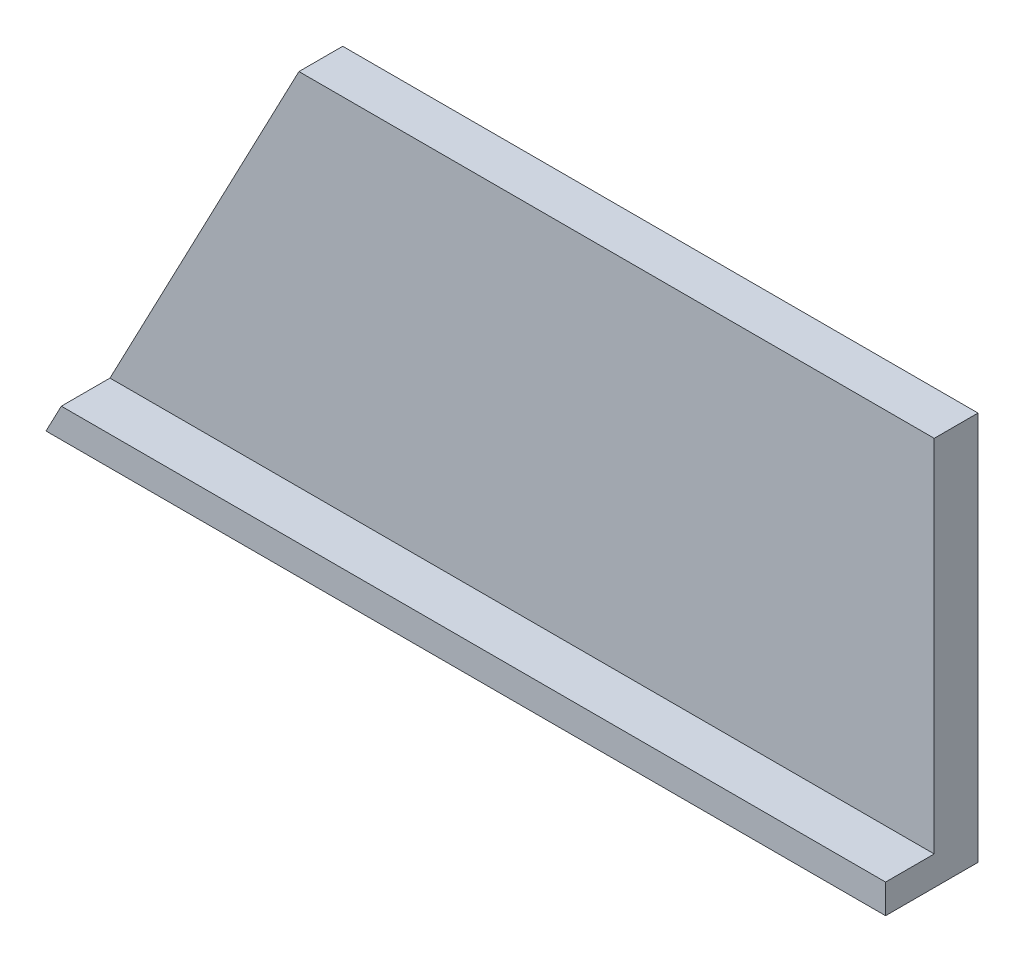
from build123d import *

# Parameters (mm, degrees)
SKETCH_1_W           = 135.4
SKETCH_1_H           = 96.8
EXTRUDE_1_DEPTH      = 4.5
SKETCH_2_W           = 135.4
SKETCH_2_H           = 4.5
EXTRUDE_2_DEPTH      = 40
CUT_EXTRUDE_1_DEPTH  = 40
SKETCH_4_W           = 96.8
SKETCH_4_H           = 4.5
EXTRUDE_3_DEPTH      = 21
SKETCH_5_W           = 96.8
SKETCH_5_H           = 4.5
EXTRUDE_4_DEPTH      = 21
SKETCH_6_W           = 2.5
SKETCH_6_H           = 87.8
CUT_EXTRUDE_2_DEPTH  = 189.231772026
SKETCH_7_W           = 21
SKETCH_7_H           = 4.5
EXTRUDE_6_DEPTH      = 40
SKETCH_9_W           = 4.8
SKETCH_9_H           = 40
CUT_EXTRUDE_4_DEPTH  = 187.977271346
CUT_EXTRUDE_5_DEPTH  = 190.23913443
SKETCH_11_W          = 80
SKETCH_11_H          = 50
CUT_EXTRUDE_6_DEPTH  = 0.3
SKETCH_12_W          = 2.153500311
SKETCH_12_H          = 0.443228659
SKETCH_12_H_2        = 0.381767619
SKETCH_12_W_2        = 2.028214344
SKETCH_12_H_3        = 1.758731319
EXTRUDE_9_DEPTH      = 0.1
SKETCH_13_W          = 177.4
SKETCH_13_H          = 4.5
CUT_EXTRUDE_7_DEPTH  = 100
CUT_EXTRUDE_8_DEPTH  = 119
EXTRUDE_10_DEPTH     = 5
SKETCH_16_W          = 4.8
SKETCH_16_H          = 3
CUT_EXTRUDE_9_DEPTH  = 5
SKETCH_17_OUTSIDE_W  = 215.82
SKETCH_17_OUTSIDE_H  = 78.42
CUT_EXTRUDE_11_DEPTH = 50


with BuildPart() as part:
    # 草图1 → 凸台-拉伸1 (new body)
    with BuildSketch(Plane(origin=(0, 0, 0), x_dir=(1, 0, 0), z_dir=(0, 1, 0))):
        with Locations((67.7, -48.4)):
            Rectangle(SKETCH_1_W, SKETCH_1_H)
        with BuildLine():
            Line((9.5, -21.9), (35.5, -21.9))
            ThreePointArc((35.5, -21.9), (38.681980515, -23.218019485), (40, -26.4))
            Line((40, -26.4), (40, -70.4))
            ThreePointArc((40, -70.4), (38.681980515, -73.581980515), (35.5, -74.9))
            Line((35.5, -74.9), (9.5, -74.9))
            ThreePointArc((9.5, -74.9), (6.318019485, -73.581980515), (5, -70.4))
            Line((5, -70.4), (5, -26.4))
            ThreePointArc((5, -26.4), (6.318019485, -23.218019485), (9.5, -21.9))
        make_face(mode=Mode.SUBTRACT)
    extrude(amount=EXTRUDE_1_DEPTH)

    # 草图2 → 凸台-拉伸2 (add)
    with BuildSketch(Plane(origin=(0, 4.5, 0), x_dir=(1, 0, 0), z_dir=(0, 1, 0))):
        with Locations((67.7, -2.25)):
            Rectangle(SKETCH_2_W, SKETCH_2_H)
        with Locations((67.7, -94.55)):
            Rectangle(SKETCH_2_W, SKETCH_2_H)
    extrude(amount=EXTRUDE_2_DEPTH)

    # 草图3 → 切除-拉伸1 (cut)
    with BuildSketch(Plane.XY.offset(96.8)):
        with BuildLine():
            Line((47.7, 44.5), (87.7, 44.5))
            ThreePointArc((87.7, 44.5), (67.7, 24.5), (47.7, 44.5))
        make_face()
    extrude(amount=-CUT_EXTRUDE_1_DEPTH, mode=Mode.SUBTRACT)

    # 草图4 → 凸台-拉伸3 (add)
    with BuildSketch(Plane.ZY):
        with Locations((48.4, 2.25)):
            Rectangle(SKETCH_4_W, SKETCH_4_H)
    extrude(amount=EXTRUDE_3_DEPTH)

    # 草图5 → 凸台-拉伸4 (add)
    with BuildSketch(Plane(origin=(135.4, 0, 0), x_dir=(0, 0, -1), z_dir=(1, 0, 0))):
        with Locations((-48.4, 2.25)):
            Rectangle(SKETCH_5_W, SKETCH_5_H)
    extrude(amount=EXTRUDE_4_DEPTH)

    # 草图6 → 切除-拉伸2 (cut, through all)
    with BuildSketch(Plane(origin=(0, 4.5, 0), x_dir=(1, 0, 0), z_dir=(0, 1, 0))):
        with Locations((-15.25, -48.4)):
            Rectangle(SKETCH_6_W, SKETCH_6_H)
        with Locations((150.65, -48.4)):
            Rectangle(SKETCH_6_W, SKETCH_6_H)
    extrude(amount=-CUT_EXTRUDE_2_DEPTH, mode=Mode.SUBTRACT)

    # 草图7 → 凸台-拉伸6 (add)
    with BuildSketch(Plane(origin=(0, 4.5, 0), x_dir=(1, 0, 0), z_dir=(0, 1, 0))):
        with Locations((145.9, -2.25)):
            Rectangle(SKETCH_7_W, SKETCH_7_H)
        with Locations((145.9, -94.55)):
            Rectangle(SKETCH_7_W, SKETCH_7_H)
        with Locations((-10.5, -2.25)):
            Rectangle(SKETCH_7_W, SKETCH_7_H)
        with Locations((-10.5, -94.55)):
            Rectangle(SKETCH_7_W, SKETCH_7_H)
    extrude(amount=EXTRUDE_6_DEPTH)

    # 草图9 → 切除-拉伸4 (cut, through all)
    with BuildSketch(Plane.XY.offset(4.5)):
        with Locations((67.7, 24.5)):
            Rectangle(SKETCH_9_W, SKETCH_9_H)
    extrude(amount=-CUT_EXTRUDE_4_DEPTH, mode=Mode.SUBTRACT)

    # 草图10 → 切除-拉伸5 (cut, through all)
    with BuildSketch(Plane.XY.offset(96.8)):
        Polygon((-21, 44.5), (0, 44.5), (-21, 4.5), align=None)
        Polygon((156.4, 44.5), (156.4, 4.5), (135.4, 44.5), align=None)
    extrude(amount=-CUT_EXTRUDE_5_DEPTH, mode=Mode.SUBTRACT)

    # 草图11 → 切除-拉伸6 (cut)
    with BuildSketch(Plane(origin=(0, 4.5, 0), x_dir=(1, 0, 0), z_dir=(0, 1, 0))):
        with Locations((85, -48.4)):
            Rectangle(SKETCH_11_W, SKETCH_11_H)
    extrude(amount=-CUT_EXTRUDE_6_DEPTH, mode=Mode.SUBTRACT)

    # 草图12 → 凸台-拉伸9 (add)
    # profile 1 of 21: a face of its own
    with BuildSketch(Plane(origin=(0, 4.2, 0), x_dir=(1, 0, 0), z_dir=(0, 1, 0))):
        with BuildLine():
            add(Edge.make_bspline(
                [(55.920909817, -50.5126391), (55.920330094, -50.418868998), (55.919099918, -50.219888299), (55.912694211, -49.904697314), (55.90362345, -49.555593656), (55.89402315, -49.311775096), (55.888997354, -49.184135066)],
                knots=[0, 0, 0, 0, 0.846714356, 1.796732788, 2.846580448, 4, 4, 4, 4], degree=3))
            Line((55.888997354, -49.184135066), (59.749223488, -49.184135066))
            add(Edge.make_bspline(
                [(59.749223488, -49.184135066), (59.74055538, -49.373608041), (59.723170988, -49.75360709), (59.720055186, -50.133991074), (59.718492968, -50.324710148)],
                knots=[0, 0, 0, 0, 0.99722868, 2, 2, 2, 2], degree=3))
            Line((59.718492968, -50.324710148), (59.718492968, -52.579857565))
            add(Edge.make_bspline(
                [(59.718492968, -52.579857565), (59.71798715, -52.605122659), (59.717024459, -52.653208083), (59.704986083, -52.722074896), (59.684640987, -52.783951707), (59.65799795, -52.839788518), (59.622634473, -52.888914206), (59.578530881, -52.930003935), (59.52709026, -52.964775361), (59.467204321, -52.992030744), (59.397753988, -53.0151107), (59.318440926, -53.040265713), (59.226546722, -53.06306035), (59.123911109, -53.088329714), (59.009539611, -53.112783948), (58.883350064, -53.137434655), (58.746057432, -53.163880054), (58.650062109, -53.179362552), (58.600374804, -53.187376314)],
                knots=[0, 0, 0, 0, 0.861425415, 1.63949542, 2.375049245, 3.07857147, 3.742842006, 4.427614151, 5.124942369, 5.852713644, 6.664885679, 7.621751021, 8.691368886, 9.89467842, 11.229057471, 12.681927417, 14.282561253, 16, 16, 16, 16], degree=3))
            add(Edge.make_bspline(
                [(58.600374804, -53.187376314), (58.586214482, -53.131585528), (58.556874712, -53.015988665), (58.4952126, -52.841603581), (58.420519449, -52.658635864), (58.362238898, -52.535851938), (58.332073722, -52.472300744)],
                knots=[0, 0, 0, 0, 0.902150766, 1.869229773, 2.897143974, 4, 4, 4, 4], degree=3))
            add(Edge.make_bspline(
                [(58.332073722, -52.472300744), (58.376216536, -52.47238952), (58.45863941, -52.472555281), (58.573250507, -52.465750067), (58.670595079, -52.459059081), (58.749703971, -52.445709284), (58.812325783, -52.431533402), (58.857220167, -52.413315464), (58.889603756, -52.39049656), (58.893976113, -52.369196405), (58.895860576, -52.36001615)],
                knots=[0, 0, 0, 0, 1.768003875, 3.301193302, 4.600280842, 5.672042812, 6.518131118, 7.154449636, 7.635572213, 8, 8, 8, 8], degree=3))
            Line((58.895860576, -52.36001615), (58.895860576, -51.80923067))
            Line((58.895860576, -51.80923067), (56.742360265, -51.80923067))
            Line((56.742360265, -51.80923067), (56.742360265, -53.12473333))
            Line((56.742360265, -53.12473333), (55.888997354, -53.12473333))
            add(Edge.make_bspline(
                [(55.888997354, -53.12473333), (55.894059779, -53.010096982), (55.903991116, -52.785206311), (55.912915781, -52.454211625), (55.919236293, -52.136652824), (55.920360552, -51.929397779), (55.920909817, -51.82814176)],
                knots=[0, 0, 0, 0, 1.061575059, 2.08257095, 3.063225531, 4, 4, 4, 4], degree=3))
            Line((55.920909817, -51.82814176), (55.920909817, -50.5126391))
        make_face()
        with Locations((57.819110421, -50.997826739)):
            Rectangle(SKETCH_12_W, SKETCH_12_H, mode=Mode.SUBTRACT)
        with Locations((57.819110421, -49.995538998)):
            Rectangle(SKETCH_12_W, SKETCH_12_H_2, mode=Mode.SUBTRACT)
    # profile 2 of 21: a face of its own
    with BuildSketch(Plane(origin=(0, 4.2, 0), x_dir=(1, 0, 0), z_dir=(0, 1, 0))):
        with BuildLine():
            add(Edge.make_bspline(
                [(55.262567515, -48.307133292), (55.314172299, -48.309672786), (55.428377233, -48.31529286), (55.61557138, -48.320271223), (55.834588916, -48.327122912), (56.084809804, -48.329450558), (56.366885362, -48.333758993), (56.680506665, -48.335329562), (57.026021094, -48.338592945), (57.266748051, -48.338113911), (57.392428965, -48.337863813)],
                knots=[0, 0, 0, 0, 0.582076541, 1.28817539, 2.109630885, 3.050725073, 4.107214628, 5.28793665, 6.584061357, 8, 8, 8, 8], degree=3))
            Line((57.392428965, -48.337863813), (57.392428965, -47.894635154))
            add(Edge.make_bspline(
                [(57.392428965, -47.894635154), (57.302994303, -47.894413367), (57.129243107, -47.893982486), (56.877100779, -47.897001733), (56.641108819, -47.899430832), (56.421636103, -47.901036551), (56.218339985, -47.905996136), (56.031222986, -47.912280913), (55.860585384, -47.917546497), (55.752279995, -47.922855393), (55.701068402, -47.925365674)],
                knots=[0, 0, 0, 0, 1.268705444, 2.464805981, 3.577075293, 4.61669139, 5.578261161, 6.46176692, 7.272655149, 8, 8, 8, 8], degree=3))
            Line((55.701068402, -47.925365674), (55.701068402, -47.304845551))
            add(Edge.make_bspline(
                [(55.701068402, -47.304845551), (55.750703873, -47.307359518), (55.855462565, -47.312665397), (56.021766797, -47.317900514), (56.206108409, -47.324726398), (56.408663176, -47.327116643), (56.629274544, -47.33142062), (56.867648064, -47.333020836), (57.124120637, -47.336286945), (57.301024134, -47.335818245), (57.392428965, -47.335576072)],
                knots=[0, 0, 0, 0, 0.705012697, 1.487972356, 2.360304969, 3.321760164, 4.361450436, 5.490484925, 6.703350675, 8, 8, 8, 8], degree=3))
            Line((57.392428965, -47.335576072), (57.392428965, -47.01763338))
            add(Edge.make_bspline(
                [(57.392428965, -47.01763338), (57.290387, -47.017406939), (57.09339152, -47.016969786), (56.807760282, -47.020007069), (56.542613252, -47.0224117), (56.297534272, -47.024024573), (56.072962679, -47.028970568), (55.868507335, -47.035223575), (55.684084168, -47.04052535), (55.56789724, -47.045853021), (55.513139451, -47.048363901)],
                knots=[0, 0, 0, 0, 1.302857261, 2.515210203, 3.647080722, 4.688409065, 5.64438486, 6.514996534, 7.300132061, 8, 8, 8, 8], degree=3))
            Line((55.513139451, -47.048363901), (55.513139451, -46.395931315))
            add(Edge.make_bspline(
                [(55.513139451, -46.395931315), (55.56790165, -46.398310987), (55.684505123, -46.40337795), (55.869245732, -46.411064564), (56.074171311, -46.414791343), (56.298720338, -46.420070317), (56.543786295, -46.423485186), (56.808943457, -46.425345015), (57.09417915, -46.428539206), (57.290780869, -46.428080791), (57.392428965, -46.427843778)],
                knots=[0, 0, 0, 0, 0.699858885, 1.490188073, 2.360657684, 3.316621111, 4.35799673, 5.489852607, 6.702189865, 8, 8, 8, 8], degree=3))
            add(Edge.make_bspline(
                [(57.392428965, -46.427843778), (57.391709631, -46.381354277), (57.390185364, -46.28284317), (57.386304328, -46.126704689), (57.374235558, -45.953857036), (57.366012007, -45.832931491), (57.361698445, -45.769501476)],
                knots=[0, 0, 0, 0, 0.84640916, 1.793538337, 2.842627543, 4, 4, 4, 4], degree=3))
            Line((57.361698445, -45.769501476), (58.245791876, -45.769501476))
            add(Edge.make_bspline(
                [(58.245791876, -45.769501476), (58.241275133, -45.834103034), (58.232685505, -45.956957778), (58.223310923, -46.131511294), (58.216929489, -46.286359526), (58.215654455, -46.382925042), (58.215061356, -46.427843778)],
                knots=[0, 0, 0, 0, 1.178907891, 2.241964945, 3.182226582, 4, 4, 4, 4], degree=3))
            add(Edge.make_bspline(
                [(58.215061356, -46.427843778), (58.322619119, -46.428081771), (58.53025204, -46.428541199), (58.830853404, -46.425354157), (59.109799348, -46.423477164), (59.367472347, -46.420071946), (59.603447899, -46.414802202), (59.817827398, -46.411089735), (60.010054798, -46.403386721), (60.130992272, -46.398311918), (60.187724375, -46.395931315)],
                knots=[0, 0, 0, 0, 1.30828854, 2.525561765, 3.656577085, 4.701389929, 5.660034743, 6.527646624, 7.309314964, 8, 8, 8, 8], degree=3))
            Line((60.187724375, -46.395931315), (60.187724375, -47.048363901))
            add(Edge.make_bspline(
                [(60.187724375, -47.048363901), (60.129814365, -47.045855335), (60.007321026, -47.040549126), (59.813051522, -47.035216647), (59.597957386, -47.028970598), (59.361566528, -47.024021853), (59.104275147, -47.022423097), (58.826126805, -47.019997751), (58.527493848, -47.016976411), (58.321437058, -47.017409698), (58.215061356, -47.01763338)],
                knots=[0, 0, 0, 0, 0.705059618, 1.49136752, 2.363901325, 3.322559729, 4.367332429, 5.49357162, 6.706069916, 8, 8, 8, 8], degree=3))
            Line((58.215061356, -47.01763338), (58.215061356, -47.335576072))
            add(Edge.make_bspline(
                [(58.215061356, -47.335576072), (58.314345719, -47.335818777), (58.506220042, -47.336287824), (58.783180409, -47.33303934), (59.038888123, -47.331421717), (59.272502392, -47.327161962), (59.484904368, -47.324725328), (59.675552037, -47.317939921), (59.845011694, -47.312775034), (59.950554289, -47.307368147), (59.999795423, -47.304845551)],
                knots=[0, 0, 0, 0, 1.33476867, 2.579538499, 3.723674973, 4.772542158, 5.720784798, 6.57925897, 7.33715008, 8, 8, 8, 8], degree=3))
            Line((59.999795423, -47.304845551), (59.999795423, -47.925365674))
            add(Edge.make_bspline(
                [(59.999795423, -47.925365674), (59.945431559, -47.92285784), (59.830819457, -47.917570722), (59.650336054, -47.912270881), (59.452579923, -47.905993874), (59.237858317, -47.901045756), (59.006173728, -47.899426346), (58.757574115, -47.897008608), (58.492036247, -47.893980486), (58.309223748, -47.894412588), (58.215061356, -47.894635154)],
                knots=[0, 0, 0, 0, 0.731642381, 1.542478119, 2.42743214, 3.391673867, 4.429891378, 5.54225982, 6.734076184, 8, 8, 8, 8], degree=3))
            Line((58.215061356, -47.894635154), (58.215061356, -48.337863813))
            add(Edge.make_bspline(
                [(58.215061356, -48.337863813), (58.346651928, -48.338112201), (58.599198078, -48.338588902), (58.962048074, -48.335330287), (59.292609713, -48.333747363), (59.590839537, -48.32944997), (59.856422653, -48.327109403), (60.089626435, -48.320275347), (60.290602473, -48.315210414), (60.41387548, -48.309666671), (60.470208773, -48.307133292)],
                knots=[0, 0, 0, 0, 1.400188647, 2.687215702, 3.861056488, 4.917561104, 5.860885799, 6.687011529, 7.399990579, 8, 8, 8, 8], degree=3))
            Line((60.470208773, -48.307133292), (60.470208773, -48.959565878))
            add(Edge.make_bspline(
                [(60.470208773, -48.959565878), (60.444995479, -48.958350785), (60.390637369, -48.955731128), (60.303561989, -48.95227654), (60.204671798, -48.948765385), (60.09437273, -48.944916421), (59.972609732, -48.943030625), (59.839447923, -48.940510184), (59.694855256, -48.938203966), (59.538444238, -48.935912663), (59.370615869, -48.933163697), (59.190951515, -48.932448189), (58.999872062, -48.931142138), (58.797365469, -48.929972381), (58.583433614, -48.9288815), (58.35768443, -48.927299434), (58.120505664, -48.92774851), (57.958579623, -48.927685573), (57.875843689, -48.927653415)],
                knots=[0, 0, 0, 0, 0.466956731, 1.006726273, 1.612041576, 2.297480839, 3.048306558, 3.864714675, 4.761281314, 5.723433641, 6.758460155, 7.86628996, 9.047000248, 10.293303119, 11.612486774, 13.004551338, 14.469478786, 16, 16, 16, 16], degree=3))
            add(Edge.make_bspline(
                [(57.875843689, -48.927653415), (57.794289699, -48.927685364), (57.635121524, -48.927747718), (57.401488578, -48.927303356), (57.178891248, -48.928880864), (56.966929319, -48.929976032), (56.765998634, -48.931141688), (56.57570714, -48.932450242), (56.396042905, -48.933171176), (56.227426464, -48.935912361), (56.069439659, -48.938213453), (55.922483305, -48.940525571), (55.786169174, -48.943027772), (55.660467838, -48.944939572), (55.545834172, -48.94877266), (55.441823099, -48.95230655), (55.348839574, -48.955780412), (55.290145019, -48.958355826), (55.262567515, -48.959565878)],
                knots=[0, 0, 0, 0, 1.497751429, 2.923147716, 4.290679031, 5.585856274, 6.81591496, 7.980855208, 9.080677159, 10.115456873, 11.077889054, 11.982444083, 12.814654035, 13.581755042, 14.291167594, 14.921031464, 15.493049083, 16, 16, 16, 16], degree=3))
            Line((55.262567515, -48.959565878), (55.262567515, -48.307133292))
        make_face()
    # profile 3 of 21: a face of its own
    with BuildSketch(Plane(origin=(0, 4.2, 0), x_dir=(1, 0, 0), z_dir=(0, 1, 0))):
        with BuildLine():
            add(Edge.make_bspline(
                [(55.802715508, -51.299813198), (55.656129696, -51.41782192), (55.360501647, -51.655816904), (54.931943047, -52.030622643), (54.511556265, -52.408376913), (54.233123225, -52.657895343), (54.095989685, -52.780787891)],
                knots=[0, 0, 0, 0, 0.999076555, 2.01489522, 3.022298338, 4, 4, 4, 4], degree=3))
            add(Edge.make_bspline(
                [(54.095989685, -52.780787891), (54.048629577, -52.720969299), (53.956697623, -52.604853852), (53.824256624, -52.434766798), (53.694858776, -52.279754104), (53.611399335, -52.179959973), (53.571206953, -52.131901134)],
                knots=[0, 0, 0, 0, 1.097024221, 2.129462651, 3.099186963, 4, 4, 4, 4], degree=3))
            add(Edge.make_bspline(
                [(53.571206953, -52.131901134), (53.595990719, -52.111031385), (53.644224516, -52.070414992), (53.708888806, -52.004223946), (53.761878107, -51.933528904), (53.80754941, -51.861847734), (53.842360958, -51.786752752), (53.865553407, -51.708606584), (53.882142155, -51.628301706), (53.883658764, -51.573321568), (53.884421872, -51.545657361)],
                knots=[0, 0, 0, 0, 1.128626418, 2.196515935, 3.215095519, 4.201629449, 5.153656748, 6.08719632, 7.037539753, 8, 8, 8, 8], degree=3))
            Line((53.884421872, -51.545657361), (53.884421872, -48.959565878))
            add(Edge.make_bspline(
                [(53.884421872, -48.959565878), (53.815869383, -48.960286548), (53.670479744, -48.96181498), (53.440311358, -48.965672136), (53.185480627, -48.977756024), (53.007419441, -48.985982531), (52.914046594, -48.990296399)],
                knots=[0, 0, 0, 0, 0.847290827, 1.79697791, 2.844765385, 4, 4, 4, 4], degree=3))
            Line((52.914046594, -48.990296399), (52.914046594, -48.275220829))
            add(Edge.make_bspline(
                [(52.914046594, -48.275220829), (52.989676068, -48.280214454), (53.131034611, -48.289548006), (53.328864083, -48.298700728), (53.49749236, -48.305168602), (53.600357251, -48.306521702), (53.64685131, -48.307133292)],
                knots=[0, 0, 0, 0, 1.239785955, 2.317275629, 3.239422833, 4, 4, 4, 4], degree=3))
            Line((53.64685131, -48.307133292), (54.707054263, -48.307133292))
            add(Edge.make_bspline(
                [(54.707054263, -48.307133292), (54.701937138, -48.39970182), (54.691424035, -48.58988332), (54.68282661, -48.883091826), (54.676629578, -49.191594115), (54.675645669, -49.402397013), (54.675141799, -49.510351359)],
                knots=[0, 0, 0, 0, 0.924137097, 1.898634279, 2.923868866, 4, 4, 4, 4], degree=3))
            Line((54.675141799, -49.510351359), (54.675141799, -51.470013003))
            add(Edge.make_bspline(
                [(54.675141799, -51.470013003), (54.726479417, -51.40094265), (54.829703305, -51.26206378), (54.997690344, -51.061971279), (55.180355931, -50.870057198), (55.310400604, -50.748776801), (55.376034052, -50.687566677)],
                knots=[0, 0, 0, 0, 0.981128507, 1.97274246, 2.976844663, 4, 4, 4, 4], degree=3))
            add(Edge.make_bspline(
                [(55.376034052, -50.687566677), (55.409108004, -50.747543323), (55.473116659, -50.863617276), (55.579592259, -51.024758392), (55.686785869, -51.170821734), (55.764987695, -51.257834582), (55.802715508, -51.299813198)],
                knots=[0, 0, 0, 0, 1.097944477, 2.124873025, 3.095360786, 4, 4, 4, 4], degree=3))
        make_face()
    # profile 4 of 21: a face of its own
    with BuildSketch(Plane(origin=(0, 4.2, 0), x_dir=(1, 0, 0), z_dir=(0, 1, 0))):
        with BuildLine():
            add(Edge.make_bspline(
                [(54.620772417, -47.706706202), (54.532105892, -47.589160189), (54.355869536, -47.35552206), (54.07242207, -47.023372666), (53.783399495, -46.702555605), (53.579320923, -46.501717189), (53.477833448, -46.40184103)],
                knots=[0, 0, 0, 0, 1.017212512, 2.021843369, 3.016270448, 4, 4, 4, 4], degree=3))
            add(Edge.make_bspline(
                [(53.477833448, -46.40184103), (53.560026822, -46.333108161), (53.725771557, -46.194506831), (53.893329821, -46.0581034), (53.977795376, -45.989342891)],
                knots=[0, 0, 0, 0, 0.991806762, 2, 2, 2, 2], degree=3))
            add(Edge.make_bspline(
                [(53.977795376, -45.989342891), (54.045796271, -46.045002617), (54.178645334, -46.153741514), (54.369043152, -46.317606669), (54.544878708, -46.479204921), (54.710260486, -46.634572722), (54.860775219, -46.788358614), (55.000128864, -46.937232972), (55.125241299, -47.083400975), (55.2018469, -47.181645089), (55.238928654, -47.229201193)],
                knots=[0, 0, 0, 0, 1.189769114, 2.324376942, 3.400485477, 4.423010638, 5.396189427, 6.313388948, 7.18357804, 8, 8, 8, 8], degree=3))
            add(Edge.make_bspline(
                [(55.238928654, -47.229201193), (55.184485961, -47.277247283), (55.079429436, -47.369960463), (54.922275624, -47.498026967), (54.771000651, -47.610019847), (54.66957463, -47.675297272), (54.620772417, -47.706706202)],
                knots=[0, 0, 0, 0, 1.114029263, 2.14971076, 3.109713586, 4, 4, 4, 4], degree=3))
        make_face()
    # profile 5 of 21: a face of its own
    with BuildSketch(Plane(origin=(0, 4.2, 0), x_dir=(1, 0, 0), z_dir=(0, 1, 0))):
        with BuildLine():
            add(Edge.make_bspline(
                [(64.280320521, -46.991630632), (64.315193545, -46.878492986), (64.381927855, -46.661988604), (64.466829057, -46.39583679), (64.528988968, -46.188537457), (64.562977258, -46.02582967), (64.593423816, -45.854490429), (64.606789555, -45.736500498), (64.613628472, -45.676127972)],
                knots=[0, 0, 0, 0, 1.56667797, 2.998052898, 3.69776078, 4.428985813, 5.196150953, 6, 6, 6, 6], degree=3))
            add(Edge.make_bspline(
                [(64.613628472, -45.676127972), (64.70274705, -45.692667799), (64.877416236, -45.725085259), (65.133615809, -45.779702822), (65.378810683, -45.838245934), (65.538015445, -45.88176611), (65.615916213, -45.903061046)],
                knots=[0, 0, 0, 0, 1.057971463, 2.073585752, 3.057382785, 4, 4, 4, 4], degree=3))
            add(Edge.make_bspline(
                [(65.615916213, -45.903061046), (65.590980607, -45.958955735), (65.544546841, -46.063039868), (65.481563185, -46.208681654), (65.430569566, -46.332356458), (65.388874544, -46.441839085), (65.348093523, -46.551978409), (65.30136357, -46.678018816), (65.242956288, -46.827158342), (65.20032728, -46.934134046), (65.177415327, -46.991630632)],
                knots=[0, 0, 0, 0, 1.251365267, 2.330226157, 3.244203, 3.986203782, 4.725357024, 5.645524874, 6.734532437, 8, 8, 8, 8], degree=3))
            Line((65.177415327, -46.991630632), (67.562576484, -46.991630632))
            add(Edge.make_bspline(
                [(67.562576484, -46.991630632), (67.78678248, -46.990165615), (68.234134674, -46.987242505), (68.681119128, -46.968878446), (68.904081892, -46.959718169)],
                knots=[0, 0, 0, 0, 1.002369049, 2, 2, 2, 2], degree=3))
            Line((68.904081892, -46.959718169), (68.904081892, -47.706706202))
            add(Edge.make_bspline(
                [(68.904081892, -47.706706202), (68.678361048, -47.6975474), (68.231370143, -47.67941039), (67.784022927, -47.676322373), (67.562576484, -47.674793739)],
                knots=[0, 0, 0, 0, 1.00995721, 2, 2, 2, 2], degree=3))
            Line((67.562576484, -47.674793739), (64.956391969, -47.674793739))
            add(Edge.make_bspline(
                [(64.956391969, -47.674793739), (64.927380374, -47.740839362), (64.865838313, -47.880941407), (64.756876407, -48.097493821), (64.6326435, -48.335631883), (64.491960506, -48.592838675), (64.333427822, -48.865568172), (64.153018915, -49.147831801), (63.953660209, -49.43960358), (63.810136858, -49.634113839), (63.736626699, -49.733738603)],
                knots=[0, 0, 0, 0, 0.721755319, 1.531053691, 2.425116919, 3.409656989, 4.464507478, 5.581195155, 6.761130329, 8, 8, 8, 8], degree=3))
            Line((63.736626699, -49.733738603), (63.736626699, -51.921515264))
            add(Edge.make_bspline(
                [(63.736626699, -51.921515264), (63.738130629, -52.140992592), (63.741096073, -52.573757278), (63.758687375, -53.006173272), (63.767357219, -53.219288777)],
                knots=[0, 0, 0, 0, 1.01430332, 2, 2, 2, 2], degree=3))
            Line((63.767357219, -53.219288777), (62.883263787, -53.219288777))
            add(Edge.make_bspline(
                [(62.883263787, -53.219288777), (62.892525162, -52.999085786), (62.910711399, -52.566680882), (62.912913588, -52.133901131), (62.913994308, -51.921515264)],
                knots=[0, 0, 0, 0, 1.018503677, 2, 2, 2, 2], degree=3))
            Line((62.913994308, -51.921515264), (62.913994308, -50.368442043))
            add(Edge.make_bspline(
                [(62.913994308, -50.368442043), (62.859865041, -50.440161886), (62.749788155, -50.58601084), (62.553875496, -50.786948281), (62.333354375, -50.979659232), (62.169362068, -51.093712652), (62.085452201, -51.152070312)],
                knots=[0, 0, 0, 0, 0.939613832, 1.910791893, 2.931015873, 4, 4, 4, 4], degree=3))
            add(Edge.make_bspline(
                [(62.085452201, -51.152070312), (62.038739122, -51.102259745), (61.94548832, -51.002825598), (61.795032693, -50.863348425), (61.638563036, -50.729396643), (61.528418344, -50.646423123), (61.47320568, -50.604830661)],
                knots=[0, 0, 0, 0, 0.996075157, 1.988411124, 2.991642928, 4, 4, 4, 4], degree=3))
            add(Edge.make_bspline(
                [(61.47320568, -50.604830661), (61.606794163, -50.510211851), (61.872449886, -50.322051707), (62.191628029, -50.070875197), (62.434152897, -49.859003987), (62.604278471, -49.690208909), (62.765971446, -49.514775625), (62.86470039, -49.390420712), (62.913994308, -49.328332123)],
                knots=[0, 0, 0, 0, 1.524307902, 3.031257706, 3.77986444, 4.521842929, 5.261977788, 6, 6, 6, 6], degree=3))
            add(Edge.make_bspline(
                [(62.913994308, -49.328332123), (62.913273869, -49.28460059), (62.911748328, -49.191998335), (62.90790338, -49.045698933), (62.895846696, -48.884676451), (62.887584447, -48.772423347), (62.883263787, -48.713721715)],
                knots=[0, 0, 0, 0, 0.852696723, 1.805599641, 2.852460399, 4, 4, 4, 4], degree=3))
            Line((62.883263787, -48.713721715), (63.424593723, -48.713721715))
            add(Edge.make_bspline(
                [(63.424593723, -48.713721715), (63.456141181, -48.675839413), (63.521080093, -48.597860533), (63.61259283, -48.471532051), (63.701719715, -48.333811972), (63.784838791, -48.187489004), (63.86531395, -48.043087385), (63.941084908, -47.90841411), (64.009227465, -47.786835597), (64.052938138, -47.71061466), (64.07348048, -47.674793739)],
                knots=[0, 0, 0, 0, 0.963897617, 1.984136456, 3.048461549, 4.170461594, 5.274324955, 6.281651267, 7.192441921, 8, 8, 8, 8], degree=3))
            Line((64.07348048, -47.674793739), (63.397409032, -47.674793739))
            add(Edge.make_bspline(
                [(63.397409032, -47.674793739), (63.275271904, -47.675303499), (63.035317528, -47.676304991), (62.681509957, -47.682532435), (62.339859747, -47.691205455), (62.116168685, -47.701599346), (62.006262014, -47.706706202)],
                knots=[0, 0, 0, 0, 1.053174794, 2.069099745, 3.051286103, 4, 4, 4, 4], degree=3))
            Line((62.006262014, -47.706706202), (62.006262014, -46.959718169))
            add(Edge.make_bspline(
                [(62.006262014, -46.959718169), (62.116168693, -46.964824574), (62.33985977, -46.975217547), (62.681903681, -46.983907727), (63.035711757, -46.990101794), (63.275665948, -46.991116043), (63.397409032, -46.991630632)],
                knots=[0, 0, 0, 0, 0.948713993, 1.930900449, 2.950222297, 4, 4, 4, 4], degree=3))
            Line((63.397409032, -46.991630632), (64.280320521, -46.991630632))
        make_face()
    # profile 6 of 21: a face of its own
    with BuildSketch(Plane(origin=(0, 4.2, 0), x_dir=(1, 0, 0), z_dir=(0, 1, 0))):
        with BuildLine():
            Line((65.858214547, -49.434707001), (65.858214547, -49.071850472))
            add(Edge.make_bspline(
                [(65.858214547, -49.071850472), (65.857522126, -48.971780183), (65.856186281, -48.77872073), (65.852704085, -48.498901961), (65.841367857, -48.239676848), (65.831979493, -48.073492876), (65.827484026, -47.993918373)],
                knots=[0, 0, 0, 0, 1.113428587, 2.148069297, 3.113232981, 4, 4, 4, 4], degree=3))
            Line((65.827484026, -47.993918373), (66.743489922, -47.993918373))
            add(Edge.make_bspline(
                [(66.743489922, -47.993918373), (66.738348267, -48.071117305), (66.727520846, -48.233684697), (66.719123239, -48.490680366), (66.712996661, -48.772788703), (66.712063586, -48.969411174), (66.711577458, -49.071850472)],
                knots=[0, 0, 0, 0, 0.86071668, 1.81251815, 2.860333183, 4, 4, 4, 4], degree=3))
            Line((66.711577458, -49.071850472), (66.711577458, -49.434707001))
            Line((66.711577458, -49.434707001), (67.281274028, -49.434707001))
            add(Edge.make_bspline(
                [(67.281274028, -49.434707001), (67.475932972, -49.433156466), (67.870902478, -49.430010379), (68.265472861, -49.411952614), (68.465581005, -49.402794537)],
                knots=[0, 0, 0, 0, 0.985691003, 2, 2, 2, 2], degree=3))
            Line((68.465581005, -49.402794537), (68.465581005, -50.149782571))
            add(Edge.make_bspline(
                [(68.465581005, -50.149782571), (68.263502748, -50.14062657), (67.868926688, -50.12274865), (67.473961615, -50.119469751), (67.281274028, -50.117870107)],
                knots=[0, 0, 0, 0, 1.024280376, 2, 2, 2, 2], degree=3))
            Line((67.281274028, -50.117870107), (66.711577458, -50.117870107))
            Line((66.711577458, -50.117870107), (66.711577458, -52.065712321))
            Line((66.711577458, -52.065712321), (67.750505435, -52.065712321))
            add(Edge.make_bspline(
                [(67.750505435, -52.065712321), (67.953045083, -52.064228107), (68.358652565, -52.06125581), (68.763858218, -52.042959783), (68.966724875, -52.033799857)],
                knots=[0, 0, 0, 0, 0.998697792, 2, 2, 2, 2], degree=3))
            Line((68.966724875, -52.033799857), (68.966724875, -52.748875427))
            add(Edge.make_bspline(
                [(68.966724875, -52.748875427), (68.761889426, -52.739614992), (68.356685802, -52.721296083), (67.951074969, -52.71918755), (67.750505435, -52.718144907)],
                knots=[0, 0, 0, 0, 1.011024764, 2, 2, 2, 2], degree=3))
            Line((67.750505435, -52.718144907), (65.214055562, -52.718144907))
            add(Edge.make_bspline(
                [(65.214055562, -52.718144907), (65.085224563, -52.718839118), (64.837797756, -52.720172387), (64.481958161, -52.723581682), (64.157323888, -52.734856371), (63.951337969, -52.744365335), (63.853639065, -52.748875427)],
                knots=[0, 0, 0, 0, 1.136006145, 2.181760411, 3.137610875, 4, 4, 4, 4], degree=3))
            Line((63.853639065, -52.748875427), (63.853639065, -52.033799857))
            add(Edge.make_bspline(
                [(63.853639065, -52.033799857), (63.950147169, -52.038947495), (64.154503492, -52.04984764), (64.478061613, -52.058154257), (64.83502164, -52.064307775), (65.084038375, -52.06523053), (65.214055562, -52.065712321)],
                knots=[0, 0, 0, 0, 0.852115214, 1.80435762, 2.853606175, 4, 4, 4, 4], degree=3))
            Line((65.214055562, -52.065712321), (65.858214547, -52.065712321))
            Line((65.858214547, -52.065712321), (65.858214547, -50.117870107))
            Line((65.858214547, -50.117870107), (65.33934153, -50.117870107))
            add(Edge.make_bspline(
                [(65.33934153, -50.117870107), (65.149017843, -50.119480687), (64.757991608, -50.122789677), (64.367356023, -50.140627122), (64.166853984, -50.149782571)],
                knots=[0, 0, 0, 0, 0.973457377, 2, 2, 2, 2], degree=3))
            Line((64.166853984, -50.149782571), (64.166853984, -49.402794537))
            add(Edge.make_bspline(
                [(64.166853984, -49.402794537), (64.363021772, -49.411954111), (64.753644487, -49.430193281), (65.144680741, -49.433206832), (65.33934153, -49.434707001)],
                knots=[0, 0, 0, 0, 1.004384954, 2, 2, 2, 2], degree=3))
            Line((65.33934153, -49.434707001), (65.858214547, -49.434707001))
        make_face()
    # profile 7 of 21: a face of its own
    with BuildSketch(Plane(origin=(0, 4.2, 0), x_dir=(1, 0, 0), z_dir=(0, 1, 0))):
        with BuildLine():
            add(Edge.make_bspline(
                [(74.300361267, -52.003069337), (74.19750355, -52.024603036), (74.000326007, -52.06588299), (73.717815244, -52.127262696), (73.461437287, -52.185277213), (73.230636017, -52.238763238), (73.025410584, -52.286194856), (72.846466116, -52.332007828), (72.693111095, -52.370857806), (72.443657327, -52.444811137), (72.079599745, -52.55189241), (71.673952386, -52.663026392), (71.351374117, -52.755571667), (71.128146737, -52.831632462), (70.925971046, -52.910519825), (70.801086706, -52.97073253), (70.741530621, -52.999447363)],
                knots=[0, 0, 0, 0, 1.192240491, 2.2855169, 3.279885381, 4.174405027, 4.973450738, 5.669435478, 6.270054934, 6.767992066, 8.620994659, 10.575301776, 11.539889526, 12.427570837, 13.250124353, 14, 14, 14, 14], degree=3))
            add(Edge.make_bspline(
                [(70.741530621, -52.999447363), (70.676154808, -52.858272107), (70.54552327, -52.576180913), (70.433468186, -52.286209236), (70.377492149, -52.141356679)],
                knots=[0, 0, 0, 0, 1.000919272, 2, 2, 2, 2], degree=3))
            add(Edge.make_bspline(
                [(70.377492149, -52.141356679), (70.431088996, -52.133980577), (70.530502938, -52.120299037), (70.667892458, -52.099795934), (70.781566298, -52.077973317), (70.848761183, -52.060485865), (70.878636019, -52.052710947)],
                knots=[0, 0, 0, 0, 1.27470452, 2.364381645, 3.272804326, 4, 4, 4, 4], degree=3))
            Line((70.878636019, -52.052710947), (70.878636019, -48.695992569))
            add(Edge.make_bspline(
                [(70.878636019, -48.695992569), (70.877941006, -48.625850343), (70.876468113, -48.477202887), (70.863778574, -48.242691834), (70.843417654, -47.984625928), (70.825402794, -47.805169839), (70.815993035, -47.711433975)],
                knots=[0, 0, 0, 0, 0.85276773, 1.807210309, 2.854633245, 4, 4, 4, 4], degree=3))
            Line((70.815993035, -47.711433975), (71.70126841, -47.711433975))
            add(Edge.make_bspline(
                [(71.70126841, -47.711433975), (71.69620259, -47.800063867), (71.68623222, -47.974502128), (71.677301157, -48.232626206), (71.671018781, -48.482424438), (71.66990303, -48.646347274), (71.669355947, -48.726723089)],
                knots=[0, 0, 0, 0, 1.048565571, 2.063750158, 3.050604154, 4, 4, 4, 4], degree=3))
            Line((71.669355947, -48.726723089), (71.669355947, -51.940426353))
            add(Edge.make_bspline(
                [(71.669355947, -51.940426353), (71.716932173, -51.924365388), (71.817537211, -51.890402752), (71.979249752, -51.84292171), (72.158453642, -51.790065712), (72.285050326, -51.756874924), (72.35133711, -51.739496028)],
                knots=[0, 0, 0, 0, 0.847273092, 1.791649932, 2.843694632, 4, 4, 4, 4], degree=3))
            Line((72.35133711, -51.739496028), (72.35133711, -47.09800551))
            add(Edge.make_bspline(
                [(72.35133711, -47.09800551), (72.35076591, -47.021963788), (72.349567136, -46.862375627), (72.343195819, -46.612187983), (72.334114135, -46.339504689), (72.324456159, -46.150468163), (72.319424647, -46.051985875)],
                knots=[0, 0, 0, 0, 0.871874341, 1.829795762, 2.86938951, 4, 4, 4, 4], degree=3))
            Line((72.319424647, -46.051985875), (73.204700022, -46.051985875))
            add(Edge.make_bspline(
                [(73.204700022, -46.051985875), (73.199638099, -46.144556415), (73.189711404, -46.326092084), (73.180783903, -46.593273717), (73.174464554, -46.849373873), (73.173337657, -47.016447859), (73.172787558, -47.09800551)],
                knots=[0, 0, 0, 0, 1.062912254, 2.08442652, 3.064907251, 4, 4, 4, 4], degree=3))
            Line((73.172787558, -47.09800551), (73.172787558, -48.369776276))
            add(Edge.make_bspline(
                [(73.172787558, -48.369776276), (73.283508965, -48.369256653), (73.495566, -48.368261455), (73.799468969, -48.356382241), (74.075494945, -48.337198277), (74.249598153, -48.316813375), (74.33227373, -48.307133292)],
                knots=[0, 0, 0, 0, 1.143404036, 2.189882497, 3.140437956, 4, 4, 4, 4], degree=3))
            Line((74.33227373, -48.307133292), (74.33227373, -49.115582366))
            add(Edge.make_bspline(
                [(74.33227373, -49.115582366), (74.142411657, -49.106327815), (73.756145928, -49.087499852), (73.369423454, -49.085744424), (73.172787558, -49.084851846)],
                knots=[0, 0, 0, 0, 0.98306455, 2, 2, 2, 2], degree=3))
            Line((73.172787558, -49.084851846), (73.172787558, -51.56456845))
            add(Edge.make_bspline(
                [(73.172787558, -51.56456845), (73.207050557, -51.554281029), (73.279409704, -51.532555288), (73.393053689, -51.499438408), (73.518072948, -51.466331179), (73.653859533, -51.432676239), (73.800027257, -51.395189984), (73.957666943, -51.359597894), (74.125111588, -51.319663469), (74.240817266, -51.294852286), (74.300361267, -51.282084052)],
                knots=[0, 0, 0, 0, 0.738406826, 1.55942238, 2.44312661, 3.40758985, 4.44699898, 5.557553262, 6.743077653, 8, 8, 8, 8], degree=3))
            Line((74.300361267, -51.282084052), (74.300361267, -52.003069337))
        make_face()
    # profile 8 of 21: a face of its own
    with BuildSketch(Plane(origin=(0, 4.2, 0), x_dir=(1, 0, 0), z_dir=(0, 1, 0))):
        with BuildLine():
            add(Edge.make_bspline(
                [(75.365291992, -45.894787444), (75.360669154, -45.98223846), (75.351155938, -46.162201626), (75.342160123, -46.439614501), (75.336058245, -46.732364146), (75.33506945, -46.932530121), (75.334561471, -47.035362527)],
                knots=[0, 0, 0, 0, 0.920890772, 1.895077115, 2.918625991, 4, 4, 4, 4], degree=3))
            Line((75.334561471, -47.035362527), (75.334561471, -48.745634179))
            add(Edge.make_bspline(
                [(75.334561471, -48.745634179), (75.385602271, -48.702869665), (75.496401067, -48.610036937), (75.678933967, -48.465361307), (75.891666137, -48.306090402), (76.126179217, -48.133676234), (76.369089701, -47.953085783), (76.605619331, -47.769335381), (76.828012184, -47.584877128), (76.969506828, -47.459653268), (77.038923408, -47.398219055)],
                knots=[0, 0, 0, 0, 0.735258864, 1.5960917, 2.571458391, 3.669531233, 4.810211554, 5.913674577, 6.976458959, 8, 8, 8, 8], degree=3))
            add(Edge.make_bspline(
                [(77.038923408, -47.398219055), (77.097576416, -47.466089322), (77.210953254, -47.59728321), (77.3694877, -47.791866966), (77.516961961, -47.972064108), (77.608454381, -48.089867636), (77.652351872, -48.146389032)],
                knots=[0, 0, 0, 0, 1.112390344, 2.150261388, 3.112506991, 4, 4, 4, 4], degree=3))
            add(Edge.make_bspline(
                [(77.652351872, -48.146389032), (77.585000056, -48.185032033), (77.453051527, -48.260737298), (77.258770166, -48.371465834), (77.073245356, -48.480066118), (76.893554291, -48.581859158), (76.72261796, -48.681521437), (76.558858333, -48.776027163), (76.403247039, -48.867339797), (76.253920535, -48.953325136), (76.112728634, -49.036090929), (75.978722416, -49.113735255), (75.853644673, -49.188824067), (75.735033051, -49.258248122), (75.624533182, -49.324394984), (75.521094734, -49.385891848), (75.42571133, -49.444001421), (75.364132922, -49.480840774), (75.334561471, -49.498531928)],
                knots=[0, 0, 0, 0, 1.388973859, 2.721130126, 3.999988273, 5.234242539, 6.415196029, 7.539332927, 8.616288651, 9.642520876, 10.621571535, 11.543806958, 12.412806848, 13.231059768, 14.002158277, 14.716449237, 15.383607669, 16, 16, 16, 16], degree=3))
            Line((75.334561471, -49.498531928), (75.334561471, -51.799775125))
            add(Edge.make_bspline(
                [(75.334561471, -51.799775125), (75.333235795, -51.832501765), (75.330751269, -51.893836635), (75.341006193, -51.979223486), (75.362254677, -52.0521867), (75.400586497, -52.109500365), (75.450073346, -52.154221644), (75.513912119, -52.181193285), (75.588837935, -52.195844343), (75.642592411, -52.192689759), (75.671415252, -52.190998288)],
                knots=[0, 0, 0, 0, 1.275743143, 2.390943294, 3.343590969, 4.208923963, 5.04750116, 5.907357308, 6.877937014, 8, 8, 8, 8], degree=3))
            Line((75.671415252, -52.190998288), (76.341576985, -52.190998288))
            add(Edge.make_bspline(
                [(76.341576985, -52.190998288), (76.357881767, -52.189790885), (76.391791828, -52.187279774), (76.442047119, -52.167762671), (76.493099777, -52.138605832), (76.538704052, -52.105870197), (76.574226794, -52.062098822), (76.601877603, -52.008133704), (76.630413228, -51.935002262), (76.660803105, -51.842566338), (76.692869106, -51.730630076), (76.724870777, -51.598628806), (76.761255297, -51.447308791), (76.782832065, -51.33929729), (76.794261188, -51.282084052)],
                knots=[0, 0, 0, 0, 0.539351765, 1.121723089, 1.76476379, 2.490873648, 2.964041199, 3.618515214, 4.491461995, 5.56509521, 6.842195718, 8.349722661, 10.066463425, 12, 12, 12, 12], degree=3))
            add(Edge.make_bspline(
                [(76.794261188, -51.282084052), (76.869543884, -51.320655614), (77.019248273, -51.397357599), (77.24908033, -51.498564603), (77.480640236, -51.588773208), (77.637143189, -51.640489518), (77.714994856, -51.666215556)],
                knots=[0, 0, 0, 0, 1.015948831, 2.020278327, 3.015196649, 4, 4, 4, 4], degree=3))
            add(Edge.make_bspline(
                [(77.714994856, -51.666215556), (77.696238833, -51.732962305), (77.660291996, -51.860885718), (77.600001731, -52.041936764), (77.537830959, -52.203869491), (77.473683934, -52.346775195), (77.404526262, -52.468629286), (77.335868158, -52.57314523), (77.262245461, -52.656699126), (77.16197621, -52.742664632), (77.023564456, -52.821436901), (76.842825293, -52.887773613), (76.645353067, -52.930663827), (76.507277933, -52.934716283), (76.436132432, -52.936804379)],
                knots=[0, 0, 0, 0, 1.254000706, 2.40335376, 3.450214402, 4.390954533, 5.233373444, 5.982515911, 6.648921073, 7.240258341, 8.364728838, 9.505788649, 10.714816256, 12, 12, 12, 12], degree=3))
            Line((76.436132432, -52.936804379), (75.503579333, -52.936804379))
            add(Edge.make_bspline(
                [(75.503579333, -52.936804379), (75.459855787, -52.938479161), (75.375557551, -52.941708111), (75.253118567, -52.938419229), (75.139646778, -52.92695543), (75.034727434, -52.907049551), (74.939008114, -52.878680871), (74.851750083, -52.843617078), (74.773857145, -52.799416973), (74.70517957, -52.746896605), (74.643726526, -52.688100343), (74.593864586, -52.619073695), (74.552244004, -52.542799514), (74.519215713, -52.45866181), (74.495434163, -52.366594046), (74.482059764, -52.26666637), (74.475603516, -52.159116136), (74.479294907, -52.085015144), (74.48119856, -52.046801231)],
                knots=[0, 0, 0, 0, 1.310878138, 2.52735021, 3.666800865, 4.724883692, 5.722213113, 6.653942831, 7.536904831, 8.396351073, 9.239508062, 10.075360541, 10.936507776, 11.837515984, 12.776694891, 13.778416472, 14.854328458, 16, 16, 16, 16], degree=3))
            Line((74.48119856, -52.046801231), (74.48119856, -47.035362527))
            add(Edge.make_bspline(
                [(74.48119856, -47.035362527), (74.480656041, -46.94553146), (74.479551865, -46.762700071), (74.473194151, -46.482962687), (74.464298683, -46.192539898), (74.454350817, -45.995238692), (74.449286096, -45.894787444)],
                knots=[0, 0, 0, 0, 0.944650099, 1.922627616, 2.942354933, 4, 4, 4, 4], degree=3))
            Line((74.449286096, -45.894787444), (75.365291992, -45.894787444))
        make_face()
    # profile 9 of 21: a face of its own
    with BuildSketch(Plane(origin=(0, 4.2, 0), x_dir=(1, 0, 0), z_dir=(0, 1, 0))):
        with BuildLine():
            add(Edge.make_bspline(
                [(84.582793379, -45.706858493), (84.580265345, -45.745066049), (84.574795022, -45.827742001), (84.569687821, -45.961366257), (84.562860853, -46.113786594), (84.560494886, -46.284834253), (84.556197697, -46.474317797), (84.554600058, -46.682357556), (84.551345769, -46.908886352), (84.551817917, -47.066091626), (84.552062859, -47.14764712)],
                knots=[0, 0, 0, 0, 0.637556256, 1.379584956, 2.226487074, 3.177920631, 4.227738209, 5.382409152, 6.642037192, 8, 8, 8, 8], degree=3))
            add(Edge.make_bspline(
                [(84.552062859, -47.14764712), (84.645831486, -47.147884178), (84.828644396, -47.14834635), (85.096542814, -47.145062096), (85.351067784, -47.143448199), (85.592562417, -47.139163398), (85.820717583, -47.136701156), (86.035793614, -47.129832369), (86.237940255, -47.12460166), (86.368319978, -47.119421137), (86.431352373, -47.1169166)],
                knots=[0, 0, 0, 0, 1.197245059, 2.334169336, 3.420791261, 4.447112271, 5.418104748, 6.333990519, 7.194563647, 8, 8, 8, 8], degree=3))
            Line((86.431352373, -47.1169166), (86.431352373, -47.86272269))
            add(Edge.make_bspline(
                [(86.431352373, -47.86272269), (86.367137715, -47.860230237), (86.234786536, -47.855093105), (86.029886147, -47.849678846), (85.813215168, -47.843481035), (85.584314326, -47.838419001), (85.343569042, -47.836802606), (85.090241536, -47.834396942), (84.825097911, -47.831349839), (84.64425533, -47.831775282), (84.552062859, -47.83199217)],
                knots=[0, 0, 0, 0, 0.820516063, 1.691144541, 2.617086077, 3.588168333, 4.614426187, 5.690986077, 6.822878442, 8, 8, 8, 8], degree=3))
            Line((84.552062859, -47.83199217), (84.552062859, -49.372064017))
            Line((84.552062859, -49.372064017), (86.148867974, -49.372064017))
            add(Edge.make_bspline(
                [(86.148867974, -49.372064017), (86.146338982, -49.420516868), (86.140871478, -49.525268562), (86.13581177, -49.693550896), (86.128926504, -49.884589596), (86.126579414, -50.097781723), (86.122269031, -50.333759014), (86.120680802, -50.592224955), (86.117418367, -50.873519046), (86.117891705, -51.068545183), (86.118137454, -51.169799458)],
                knots=[0, 0, 0, 0, 0.647551862, 1.399962105, 2.246972141, 3.198872674, 4.245412525, 5.39704943, 6.64859204, 8, 8, 8, 8], degree=3))
            add(Edge.make_bspline(
                [(86.118137454, -51.169799458), (86.117894774, -51.271841651), (86.117425335, -51.469231544), (86.120697295, -51.755647578), (86.12229224, -52.0219922), (86.126591586, -52.268608304), (86.128997159, -52.495190479), (86.135840984, -52.7019927), (86.141012074, -52.888781337), (86.14635015, -53.006544628), (86.148867974, -53.062090346)],
                knots=[0, 0, 0, 0, 1.293916108, 2.502944647, 3.632043067, 4.671280682, 5.630594262, 6.505218673, 7.294952597, 8, 8, 8, 8], degree=3))
            Line((86.148867974, -53.062090346), (85.295505063, -53.062090346))
            Line((85.295505063, -53.062090346), (85.295505063, -52.435660508))
            Line((85.295505063, -52.435660508), (83.267290719, -52.435660508))
            Line((83.267290719, -52.435660508), (83.267290719, -53.187376314))
            Line((83.267290719, -53.187376314), (82.445840271, -53.187376314))
            add(Edge.make_bspline(
                [(82.445840271, -53.187376314), (82.448342238, -53.126314), (82.453571307, -52.998694781), (82.458922007, -52.798912402), (82.465169925, -52.58263652), (82.470146019, -52.350187132), (82.471778644, -52.101563144), (82.47418251, -51.836810042), (82.477221901, -51.555906752), (82.476791638, -51.363245017), (82.476570791, -51.264354905)],
                knots=[0, 0, 0, 0, 0.762557009, 1.59373144, 2.493702643, 3.462362301, 4.494777691, 5.596014728, 6.766073754, 8, 8, 8, 8], degree=3))
            add(Edge.make_bspline(
                [(82.476570791, -51.264354905), (82.476794657, -51.16349489), (82.477228403, -50.968075328), (82.474198219, -50.684413979), (82.471781526, -50.419661059), (82.47017684, -50.173794104), (82.465188972, -49.946466097), (82.458982898, -49.738069328), (82.453639061, -49.548527231), (82.448347364, -49.428792018), (82.445840271, -49.372064017)],
                knots=[0, 0, 0, 0, 1.278927142, 2.477962968, 3.597068821, 4.636245159, 5.595648652, 6.480259612, 7.279979278, 8, 8, 8, 8], degree=3))
            Line((82.445840271, -49.372064017), (83.761342931, -49.372064017))
            Line((83.761342931, -49.372064017), (83.761342931, -46.754060071))
            add(Edge.make_bspline(
                [(83.761342931, -46.754060071), (83.760855916, -46.654772515), (83.759920448, -46.464059023), (83.753792803, -46.190223717), (83.745383147, -45.940317418), (83.734570971, -45.782087005), (83.729430468, -45.706858493)],
                knots=[0, 0, 0, 0, 1.136976211, 2.183926308, 3.136572301, 4, 4, 4, 4], degree=3))
            Line((83.729430468, -45.706858493), (84.582793379, -45.706858493))
        make_face()
        with Locations((84.281397891, -50.903862262)):
            Rectangle(SKETCH_12_W_2, SKETCH_12_H_3, mode=Mode.SUBTRACT)
    # profile 10 of 21: a face of its own
    with BuildSketch(Plane(origin=(0, 4.2, 0), x_dir=(1, 0, 0), z_dir=(0, 1, 0))):
        with BuildLine():
            add(Edge.make_bspline(
                [(82.265002978, -46.208002363), (82.262481443, -46.27182231), (82.257096847, -46.408106183), (82.251947562, -46.625620786), (82.245097684, -46.869462972), (82.242710842, -47.139771001), (82.238427962, -47.436425405), (82.236813962, -47.759500949), (82.233558784, -48.108955505), (82.234028953, -48.350864277), (82.234272458, -48.476151154)],
                knots=[0, 0, 0, 0, 0.67571221, 1.442945073, 2.301848223, 3.256449108, 4.302743328, 5.440693871, 6.674510761, 8, 8, 8, 8], degree=3))
            add(Edge.make_bspline(
                [(82.234272458, -48.476151154), (82.23403254, -48.60340789), (82.233566814, -48.850438264), (82.236841594, -49.210530481), (82.238459154, -49.549364285), (82.242740284, -49.867294869), (82.245164247, -50.163600759), (82.252052162, -50.43856992), (82.257240678, -50.692322756), (82.262491849, -50.854618496), (82.265002978, -50.932228897)],
                knots=[0, 0, 0, 0, 1.243352852, 2.413592625, 3.518394274, 4.553944479, 5.520210287, 6.41347606, 7.241318603, 8, 8, 8, 8], degree=3))
            Line((82.265002978, -50.932228897), (81.411640067, -50.932228897))
            Line((81.411640067, -50.932228897), (81.411640067, -46.860434949))
            Line((81.411640067, -46.860434949), (80.072498545, -46.860434949))
            Line((80.072498545, -46.860434949), (80.072498545, -51.026784344))
            Line((80.072498545, -51.026784344), (79.219135633, -51.026784344))
            add(Edge.make_bspline(
                [(79.219135633, -51.026784344), (79.221481289, -50.941684268), (79.226324519, -50.765972493), (79.234177507, -50.494156744), (79.237924207, -50.205330888), (79.243202828, -49.899222405), (79.246650216, -49.575757785), (79.248526586, -49.234958134), (79.251726477, -48.877228709), (79.251277601, -48.632956371), (79.251048097, -48.508063618)],
                knots=[0, 0, 0, 0, 0.811102554, 1.674737269, 2.590752523, 3.563065499, 4.591629033, 5.672708178, 6.810090882, 8, 8, 8, 8], degree=3))
            add(Edge.make_bspline(
                [(79.251048097, -48.508063618), (79.251283629, -48.384352771), (79.251739697, -48.14480807), (79.248561674, -47.79771605), (79.246667925, -47.474251437), (79.243282066, -47.174817576), (79.237975082, -46.899047901), (79.234307658, -46.647641243), (79.226502543, -46.419953749), (79.221504642, -46.276160483), (79.219135633, -46.208002363)],
                knots=[0, 0, 0, 0, 1.290653084, 2.499126926, 3.621285357, 4.665389651, 5.623244682, 6.498905758, 7.288480157, 8, 8, 8, 8], degree=3))
            Line((79.219135633, -46.208002363), (82.265002978, -46.208002363))
        make_face()
    # profile 11 of 21: a face of its own
    with BuildSketch(Plane(origin=(0, 4.2, 0), x_dir=(1, 0, 0), z_dir=(0, 1, 0))):
        with BuildLine():
            add(Edge.make_bspline(
                [(81.231984717, -47.320210811), (81.216548567, -47.407544307), (81.184880668, -47.586712579), (81.15270462, -47.866099954), (81.130409168, -48.161841164), (81.119310388, -48.474553873), (81.108918137, -48.802902755), (81.090254642, -49.147408557), (81.06043284, -49.507384341), (81.02757533, -49.883195913), (80.975222372, -50.271917281), (80.8963876, -50.671438352), (80.784924642, -51.079234775), (80.676347153, -51.425731705), (80.567966486, -51.706782911), (80.467083187, -51.920116842), (80.349459354, -52.134561911), (80.215228572, -52.350322885), (80.064157169, -52.567319913), (79.895425489, -52.784848208), (79.711195376, -53.004362292), (79.577951909, -53.146624101), (79.509893634, -53.219288777)],
                knots=[0, 0, 0, 0, 0.842743436, 1.72892294, 2.671479089, 3.660882456, 4.702524208, 5.79381691, 6.939416994, 8.135452205, 9.378860048, 10.66545103, 12.00244408, 13.395032318, 14.114725049, 14.863492182, 15.636001641, 16.438170903, 17.277471646, 18.147773847, 19.053917462, 20, 20, 20, 20], degree=3))
            add(Edge.make_bspline(
                [(79.509893634, -53.219288777), (79.457094736, -53.173395692), (79.353451113, -53.083308099), (79.188195072, -52.96779777), (79.018778402, -52.87229598), (78.901353852, -52.824513366), (78.84327773, -52.800880923)],
                knots=[0, 0, 0, 0, 1.059682667, 2.080144767, 3.050473284, 4, 4, 4, 4], degree=3))
            add(Edge.make_bspline(
                [(78.84327773, -52.800880923), (78.905401885, -52.741658328), (79.028482911, -52.6243259), (79.199746371, -52.438410904), (79.357749784, -52.24633933), (79.501855978, -52.047576712), (79.633657692, -51.842599144), (79.751942894, -51.631148768), (79.856094677, -51.413030416), (79.946886301, -51.188846633), (80.02709122, -50.95946791), (80.09761291, -50.725015644), (80.161077954, -50.486451682), (80.212319123, -50.242401824), (80.256055617, -49.994061885), (80.292089677, -49.741500824), (80.316388454, -49.483894168), (80.337379578, -49.136711744), (80.351547448, -48.705169302), (80.359969256, -48.195677596), (80.35944476, -47.69875396), (80.350920586, -47.371811335), (80.346709342, -47.210290104)],
                knots=[0, 0, 0, 0, 0.858767337, 1.701398859, 2.527814651, 3.346434206, 4.156866119, 4.965291047, 5.769464705, 6.574121495, 7.384649311, 8.200377284, 9.023777845, 9.854312349, 10.69505074, 11.547057455, 12.406639004, 13.283676221, 15.027528948, 16.727093715, 18.383068422, 20, 20, 20, 20], degree=3))
            add(Edge.make_bspline(
                [(80.346709342, -47.210290104), (80.490777738, -47.231416761), (80.785058687, -47.274571074), (81.080950113, -47.304787276), (81.231984717, -47.320210811)],
                knots=[0, 0, 0, 0, 0.97912146, 2, 2, 2, 2], degree=3))
        make_face()
    # profile 12 of 21: a face of its own
    with BuildSketch(Plane(origin=(0, 4.2, 0), x_dir=(1, 0, 0), z_dir=(0, 1, 0))):
        with BuildLine():
            add(Edge.make_bspline(
                [(81.16815979, -51.000781596), (81.224137797, -51.039993661), (81.337073351, -51.119103948), (81.499970761, -51.249440839), (81.658226813, -51.390630599), (81.813512379, -51.540961129), (81.964895078, -51.701601184), (82.111330039, -51.873706865), (82.254552238, -52.055137563), (82.344740759, -52.182318854), (82.390288946, -52.246549614)],
                knots=[0, 0, 0, 0, 0.934478905, 1.885309929, 2.850879641, 3.833923843, 4.840170351, 5.86812228, 6.923331226, 8, 8, 8, 8], degree=3))
            add(Edge.make_bspline(
                [(82.390288946, -52.246549614), (82.287485089, -52.319529295), (82.07899112, -52.467537587), (81.884770612, -52.633841731), (81.786316026, -52.718144907)],
                knots=[0, 0, 0, 0, 0.986156649, 2, 2, 2, 2], degree=3))
            add(Edge.make_bspline(
                [(81.786316026, -52.718144907), (81.700398405, -52.606496634), (81.53082798, -52.386143174), (81.259350453, -52.075599734), (80.98328328, -51.782078153), (80.788237443, -51.601709518), (80.691836724, -51.512562954)],
                knots=[0, 0, 0, 0, 1.036462762, 2.045604024, 3.03404666, 4, 4, 4, 4], degree=3))
            add(Edge.make_bspline(
                [(80.691836724, -51.512562954), (80.736085315, -51.472916299), (80.824132367, -51.394026303), (80.94608968, -51.267025075), (81.061824602, -51.136941009), (81.132778851, -51.046085959), (81.16815979, -51.000781596)],
                knots=[0, 0, 0, 0, 1.01772852, 2.025103937, 3.015229125, 4, 4, 4, 4], degree=3))
        make_face()
    # profile 13 of 21: a face of its own
    with BuildSketch(Plane(origin=(0, 4.2, 0), x_dir=(1, 0, 0), z_dir=(0, 1, 0))):
        Polygon((90.981360495, -52.247731557), (89.997983844, -52.247731557), (88.274710817, -48.363866561), (88.444910622, -48.363866561), (88.444910622, -52.247731557), (87.496992264, -52.247731557), (87.496992264, -46.741058697), (88.473277257, -46.741058697), (90.19536834, -50.624923693), (90.034624079, -50.624923693), (90.034624079, -46.741058697), (90.981360495, -46.741058697), align=None)
    # profile 14 of 21: a face of its own
    with BuildSketch(Plane(origin=(0, 4.2, 0), x_dir=(1, 0, 0), z_dir=(0, 1, 0))):
        Polygon((95.644835154, -47.486864787), (93.076472818, -47.486864787), (93.076472818, -49.089579618), (95.018405316, -49.089579618), (95.018405316, -49.836567652), (93.076472818, -49.836567652), (93.076472818, -52.247731557), (92.128554459, -52.247731557), (92.128554459, -46.741058697), (95.644835154, -46.741058697), align=None)
    # profile 15 of 21: a face of its own
    with BuildSketch(Plane(origin=(0, 4.2, 0), x_dir=(1, 0, 0), z_dir=(0, 1, 0))):
        with BuildLine():
            add(Edge.make_bspline(
                [(100.276397349, -49.966581392), (100.272564543, -50.069103777), (100.265177501, -50.266697156), (100.233705591, -50.551195147), (100.19022445, -50.812964983), (100.129823456, -51.051647968), (100.056170614, -51.267659044), (99.96764133, -51.460520436), (99.864728625, -51.630805848), (99.745306126, -51.776718182), (99.615163783, -51.902450686), (99.478183528, -52.012034522), (99.332481821, -52.103112934), (99.180818807, -52.180262372), (99.0199763, -52.237325919), (98.852497449, -52.280817315), (98.676792981, -52.305677913), (98.557139317, -52.308793006), (98.496391055, -52.310374541)],
                knots=[0, 0, 0, 0, 1.482401034, 2.857060218, 4.133997002, 5.314846361, 6.411567338, 7.428130549, 8.376436763, 9.27912498, 10.144921642, 10.988004862, 11.809523674, 12.624443993, 13.442263899, 14.270935373, 15.122152493, 16, 16, 16, 16], degree=3))
            add(Edge.make_bspline(
                [(98.496391055, -52.310374541), (98.431658885, -52.308719791), (98.304251301, -52.305462868), (98.117112214, -52.274789394), (97.937385944, -52.225282597), (97.765262743, -52.154646684), (97.59990503, -52.065924893), (97.442894753, -51.955918493), (97.294134026, -51.825952693), (97.150892985, -51.678721688), (97.021780159, -51.507610706), (96.90889785, -51.312776406), (96.813358671, -51.094769345), (96.737511702, -50.853085205), (96.677438925, -50.589421122), (96.634294991, -50.302643891), (96.608167783, -49.992284627), (96.605487456, -49.777524071), (96.604100167, -49.666367847)],
                knots=[0, 0, 0, 0, 0.848489166, 1.670019017, 2.4799439, 3.288895563, 4.105077194, 4.93652618, 5.797465653, 6.69288787, 7.626160145, 8.601093111, 9.639980309, 10.741460889, 11.918544379, 13.183628388, 14.542296409, 16, 16, 16, 16], degree=3))
            add(Edge.make_bspline(
                [(96.604100167, -49.666367847), (96.60562701, -49.54537707), (96.608584673, -49.311004737), (96.633016204, -48.971112648), (96.675805749, -48.65512215), (96.732200959, -48.361955862), (96.808244029, -48.093046386), (96.898595682, -47.846381663), (97.006771046, -47.623273181), (97.133205727, -47.425002332), (97.271193188, -47.249255793), (97.421130889, -47.097235209), (97.579601089, -46.966403289), (97.75047337, -46.862035289), (97.930201876, -46.779766477), (98.119703273, -46.719753537), (98.320203315, -46.685267547), (98.457255852, -46.680729227), (98.527121575, -46.678415713)],
                knots=[0, 0, 0, 0, 1.458264905, 2.824818205, 4.104224914, 5.300040087, 6.420045689, 7.468856555, 8.462800509, 9.402117889, 10.298034277, 11.150972082, 11.971253286, 12.768615827, 13.55700481, 14.348519757, 15.158119472, 16, 16, 16, 16], degree=3))
            add(Edge.make_bspline(
                [(98.527121575, -46.678415713), (98.590655188, -46.679803261), (98.715128866, -46.682521714), (98.897141198, -46.709829699), (99.070257793, -46.751324589), (99.233916718, -46.812503985), (99.388022733, -46.890790724), (99.533065248, -46.985976518), (99.668745061, -47.097965206), (99.794150772, -47.226720004), (99.906253569, -47.372306164), (100.003854504, -47.532625165), (100.084165379, -47.708183172), (100.149814452, -47.897945276), (100.195938928, -48.103849648), (100.227824872, -48.323907774), (100.243015262, -48.558678446), (100.240863488, -48.719617588), (100.239757114, -48.802367447)],
                knots=[0, 0, 0, 0, 0.98329779, 1.926455739, 2.843982155, 3.735954417, 4.625544349, 5.515720005, 6.417282526, 7.344998052, 8.293293398, 9.257068404, 10.245332615, 11.277670429, 12.361108735, 13.507915308, 14.718648201, 16, 16, 16, 16], degree=3))
            Line((100.239757114, -48.802367447), (99.328478991, -48.802367447))
            add(Edge.make_bspline(
                [(99.328478991, -48.802367447), (99.327765436, -48.742861162), (99.326384643, -48.627711022), (99.316795262, -48.461722662), (99.302366972, -48.308892838), (99.279373457, -48.16972571), (99.252198358, -48.043341982), (99.216447147, -47.930398848), (99.175478682, -47.830413972), (99.128006832, -47.74311686), (99.074129799, -47.66719472), (99.013882588, -47.602314943), (98.947856937, -47.54666455), (98.875508937, -47.50150548), (98.796478221, -47.467157654), (98.711904538, -47.442471782), (98.621494688, -47.426422071), (98.559104432, -47.42496747), (98.527121575, -47.424221803)],
                knots=[0, 0, 0, 0, 1.585307092, 3.067715195, 4.428641525, 5.672837872, 6.823885522, 7.869606975, 8.82480222, 9.69854991, 10.511210369, 11.298529173, 12.051147105, 12.805519735, 13.562225631, 14.339403232, 15.14873519, 16, 16, 16, 16], degree=3))
            add(Edge.make_bspline(
                [(98.527121575, -47.424221803), (98.495085571, -47.425515436), (98.431001424, -47.428103191), (98.336982617, -47.451285579), (98.247334926, -47.490079784), (98.160597779, -47.542939938), (98.078905475, -47.61201089), (97.999378515, -47.694706184), (97.925982824, -47.793620632), (97.853760342, -47.906777283), (97.787732265, -48.039579536), (97.733609493, -48.19556831), (97.686579628, -48.373803871), (97.647899115, -48.575180665), (97.619346777, -48.799853536), (97.598382941, -49.047491991), (97.585466209, -49.317952887), (97.583678203, -49.50600271), (97.582749046, -49.603724863)],
                knots=[0, 0, 0, 0, 0.590295346, 1.180814347, 1.77343159, 2.386679552, 3.047359721, 3.741299997, 4.498605365, 5.315209943, 6.215523342, 7.227011791, 8.355259962, 9.61382919, 11.006591543, 12.5311607, 14.197379606, 16, 16, 16, 16], degree=3))
            add(Edge.make_bspline(
                [(97.582749046, -49.603724863), (97.58380518, -49.693958074), (97.585830771, -49.867019028), (97.596982229, -50.115478723), (97.617618792, -50.342006688), (97.648624443, -50.546214898), (97.684995088, -50.72915521), (97.732128762, -50.88933671), (97.787037067, -51.028031105), (97.851605758, -51.14529994), (97.922145307, -51.244313462), (97.996091581, -51.328762059), (98.071542003, -51.401362869), (98.149709338, -51.461856856), (98.23269655, -51.506848942), (98.317737537, -51.54081022), (98.406523398, -51.559886256), (98.46636605, -51.563004118), (98.496391055, -51.56456845)],
                knots=[0, 0, 0, 0, 1.817300448, 3.485454456, 5.007677947, 6.395779374, 7.643808889, 8.761010638, 9.754104296, 10.641928893, 11.449934523, 12.197852074, 12.899380163, 13.556372665, 14.181395525, 14.794365802, 15.395094112, 16, 16, 16, 16], degree=3))
            add(Edge.make_bspline(
                [(98.496391055, -51.56456845), (98.522074626, -51.563702571), (98.573051214, -51.56198398), (98.64875994, -51.546703869), (98.723412785, -51.523718259), (98.795447195, -51.488570582), (98.866068318, -51.445186864), (98.936279716, -51.393618172), (99.002637932, -51.329742609), (99.07145488, -51.25888904), (99.133556605, -51.169886355), (99.186673185, -51.060189951), (99.230671032, -50.92938405), (99.266562452, -50.777778782), (99.294725519, -50.605169204), (99.313619242, -50.411321938), (99.327410824, -50.196074906), (99.328112119, -50.045402941), (99.328478991, -49.966581392)],
                knots=[0, 0, 0, 0, 0.61300632, 1.216691023, 1.83887932, 2.474661654, 3.125253232, 3.818056988, 4.550705127, 5.323264481, 6.174613163, 7.130212599, 8.225692184, 9.465396086, 10.84885971, 12.400873174, 14.117176265, 16, 16, 16, 16], degree=3))
            Line((99.328478991, -49.966581392), (100.276397349, -49.966581392))
        make_face()
    # profile 16 of 21: a face of its own
    with BuildSketch(Plane(origin=(0, 4.2, 0), x_dir=(1, 0, 0), z_dir=(0, 1, 0))):
        with BuildLine():
            add(Edge.make_bspline(
                [(103.302880828, -46.771789217), (103.301460437, -46.613363179), (103.298649869, -46.299881031), (103.280129167, -45.986935263), (103.270968364, -45.83214446)],
                knots=[0, 0, 0, 0, 1.010749989, 2, 2, 2, 2], degree=3))
            Line((103.270968364, -45.83214446), (104.218886723, -45.83214446))
            add(Edge.make_bspline(
                [(104.218886723, -45.83214446), (104.209250788, -45.902600327), (104.189323277, -46.048305972), (104.169825567, -46.275857881), (104.157873847, -46.518721298), (104.156797073, -46.685886342), (104.156243739, -46.771789217)],
                knots=[0, 0, 0, 0, 0.905202671, 1.871996548, 2.906460285, 4, 4, 4, 4], degree=3))
            Line((104.156243739, -46.771789217), (105.80860018, -46.771789217))
            add(Edge.make_bspline(
                [(105.80860018, -46.771789217), (105.808096864, -46.678411601), (105.807115616, -46.496365619), (105.800947972, -46.230803928), (105.792345479, -45.979735372), (105.781806556, -45.817547097), (105.776687717, -45.738770956)],
                knots=[0, 0, 0, 0, 1.083994213, 2.113320061, 3.083624486, 4, 4, 4, 4], degree=3))
            Line((105.776687717, -45.738770956), (106.692693612, -45.738770956))
            add(Edge.make_bspline(
                [(106.692693612, -45.738770956), (106.688040798, -45.811246748), (106.678184218, -45.964780359), (106.669331801, -46.209519967), (106.663408327, -46.481395887), (106.662459186, -46.672108296), (106.661963092, -46.771789217)],
                knots=[0, 0, 0, 0, 0.843082251, 1.785995843, 2.842791749, 4, 4, 4, 4], degree=3))
            Line((106.661963092, -46.771789217), (107.355763686, -46.771789217))
            add(Edge.make_bspline(
                [(107.355763686, -46.771789217), (107.4597774, -46.771242629), (107.670971788, -46.770132811), (107.993261859, -46.763882443), (108.326197492, -46.754615471), (108.551898145, -46.745625158), (108.666538573, -46.741058697)],
                knots=[0, 0, 0, 0, 0.951914802, 1.932813051, 2.950011026, 4, 4, 4, 4], degree=3))
            Line((108.666538573, -46.741058697), (108.666538573, -47.486864787))
            add(Edge.make_bspline(
                [(108.666538573, -47.486864787), (108.443183352, -47.477602997), (108.006440649, -47.459492746), (107.569330632, -47.457236596), (107.355763686, -47.456134267)],
                knots=[0, 0, 0, 0, 1.022822912, 2, 2, 2, 2], degree=3))
            Line((107.355763686, -47.456134267), (106.661963092, -47.456134267))
            add(Edge.make_bspline(
                [(106.661963092, -47.456134267), (106.663514075, -47.639763356), (106.666600528, -48.00518498), (106.684025109, -48.370203511), (106.692693612, -48.551795512)],
                knots=[0, 0, 0, 0, 1.005025854, 2, 2, 2, 2], degree=3))
            Line((106.692693612, -48.551795512), (105.80860018, -48.551795512))
            Line((105.80860018, -48.551795512), (105.80860018, -47.456134267))
            Line((105.80860018, -47.456134267), (104.156243739, -47.456134267))
            Line((104.156243739, -47.456134267), (104.156243739, -48.583707975))
            Line((104.156243739, -48.583707975), (103.240237844, -48.583707975))
            add(Edge.make_bspline(
                [(103.240237844, -48.583707975), (103.258655882, -48.397109036), (103.295665854, -48.022149359), (103.300468315, -47.64539604), (103.302880828, -47.456134267)],
                knots=[0, 0, 0, 0, 0.995301366, 2, 2, 2, 2], degree=3))
            Line((103.302880828, -47.456134267), (102.406967965, -47.456134267))
            add(Edge.make_bspline(
                [(102.406967965, -47.456134267), (102.339597258, -47.456860764), (102.193420036, -47.458437076), (101.956956616, -47.462391252), (101.685972969, -47.474507594), (101.493720617, -47.482580129), (101.39167885, -47.486864787)],
                knots=[0, 0, 0, 0, 0.795901169, 1.72690221, 2.79350805, 4, 4, 4, 4], degree=3))
            Line((101.39167885, -47.486864787), (101.39167885, -46.741058697))
            add(Edge.make_bspline(
                [(101.39167885, -46.741058697), (101.486225542, -46.745600086), (101.668979474, -46.75437836), (101.932966434, -46.763692272), (102.176853291, -46.77002574), (102.332502186, -46.771218551), (102.406967965, -46.771789217)],
                knots=[0, 0, 0, 0, 1.118145206, 2.16131763, 3.12033482, 4, 4, 4, 4], degree=3))
            Line((102.406967965, -46.771789217), (103.302880828, -46.771789217))
        make_face()
    # profile 17 of 21: a face of its own
    with BuildSketch(Plane(origin=(0, 4.2, 0), x_dir=(1, 0, 0), z_dir=(0, 1, 0))):
        with BuildLine():
            add(Edge.make_bspline(
                [(104.249617243, -49.152222602), (104.240950268, -49.311352882), (104.223667437, -49.628674826), (104.220477149, -49.946450751), (104.218886723, -50.104868733)],
                knots=[0, 0, 0, 0, 1.002957933, 2, 2, 2, 2], degree=3))
            Line((104.218886723, -50.104868733), (104.218886723, -51.921515264))
            add(Edge.make_bspline(
                [(104.218886723, -51.921515264), (104.21906818, -51.94520289), (104.219405236, -51.989202488), (104.228696776, -52.05029711), (104.238897135, -52.102507623), (104.25699918, -52.145594309), (104.280614147, -52.178919597), (104.308733661, -52.204488415), (104.343294438, -52.219237437), (104.36807156, -52.220882733), (104.380812926, -52.221728809)],
                knots=[0, 0, 0, 0, 1.49006125, 2.767778231, 3.887733343, 4.832872444, 5.686930868, 6.443449427, 7.199560708, 8, 8, 8, 8], degree=3))
            Line((104.380812926, -52.221728809), (106.072173489, -52.221728809))
            add(Edge.make_bspline(
                [(106.072173489, -52.221728809), (106.100300876, -52.221013479), (106.153072523, -52.219671401), (106.225634603, -52.198968287), (106.285849658, -52.166869378), (106.327725446, -52.126613256), (106.353200287, -52.078097984), (106.376580954, -52.024180875), (106.400415857, -51.950925357), (106.429404743, -51.860322973), (106.458073129, -51.749979811), (106.490078656, -51.621168893), (106.524074763, -51.473735775), (106.547023316, -51.369176159), (106.559134043, -51.313996515)],
                knots=[0, 0, 0, 0, 0.895913546, 1.680882502, 2.385098163, 3.061542562, 3.495577247, 4.126954351, 4.939007675, 5.954220652, 7.16640049, 8.579885, 10.195089686, 12, 12, 12, 12], degree=3))
            add(Edge.make_bspline(
                [(106.559134043, -51.313996515), (106.632120351, -51.355547156), (106.773365017, -51.435956845), (106.990921377, -51.5309936), (107.201752224, -51.608584551), (107.344295245, -51.639397662), (107.413678897, -51.654396125)],
                knots=[0, 0, 0, 0, 1.089627883, 2.108671219, 3.079384611, 4, 4, 4, 4], degree=3))
            add(Edge.make_bspline(
                [(107.413678897, -51.654396125), (107.398141776, -51.70922282), (107.368199347, -51.81488231), (107.32136411, -51.966515837), (107.272217781, -52.105283946), (107.224486098, -52.232484791), (107.176185326, -52.347319956), (107.127632051, -52.449456515), (107.079303536, -52.53975118), (107.029728704, -52.619992071), (106.971794352, -52.6903888), (106.899020197, -52.749091924), (106.811353911, -52.797077856), (106.710007424, -52.837028826), (106.594389385, -52.868959436), (106.464091428, -52.890665837), (106.31945218, -52.903352363), (106.218367596, -52.905139835), (106.165546993, -52.906073858)],
                knots=[0, 0, 0, 0, 1.377911933, 2.655448643, 3.836495628, 4.936994319, 5.940213933, 6.847828399, 7.670473116, 8.415729925, 9.125624861, 9.86360055, 10.661208089, 11.533331936, 12.492525784, 13.555950352, 14.722889586, 16, 16, 16, 16], degree=3))
            Line((106.165546993, -52.906073858), (104.160971512, -52.906073858))
            add(Edge.make_bspline(
                [(104.160971512, -52.906073858), (104.096193531, -52.90478793), (103.974462587, -52.902371409), (103.804675951, -52.870978146), (103.659065067, -52.823342235), (103.539357178, -52.75212143), (103.444691449, -52.660641969), (103.37997162, -52.546017008), (103.339835669, -52.41268936), (103.335756996, -52.316987862), (103.333611348, -52.266642646)],
                knots=[0, 0, 0, 0, 1.301744693, 2.44624188, 3.46168123, 4.36856731, 5.226299247, 6.078886216, 6.989369142, 8, 8, 8, 8], degree=3))
            Line((103.333611348, -52.266642646), (103.333611348, -50.104868733))
            add(Edge.make_bspline(
                [(103.333611348, -50.104868733), (103.33273184, -49.942894131), (103.331006071, -49.625067699), (103.312134726, -49.307800301), (103.302880828, -49.152222602)],
                knots=[0, 0, 0, 0, 1.019264512, 2, 2, 2, 2], degree=3))
            Line((103.302880828, -49.152222602), (104.249617243, -49.152222602))
        make_face()
    # profile 18 of 21: a face of its own
    with BuildSketch(Plane(origin=(0, 4.2, 0), x_dir=(1, 0, 0), z_dir=(0, 1, 0))):
        with BuildLine():
            add(Edge.make_bspline(
                [(103.028670031, -49.554083253), (103.017499115, -49.583975874), (102.99407166, -49.646666176), (102.960306593, -49.745750716), (102.924267584, -49.853920698), (102.88843415, -49.972103235), (102.848593518, -50.099273722), (102.810548118, -50.236895225), (102.768530628, -50.383162908), (102.726626689, -50.53957629), (102.680469116, -50.706050653), (102.628350076, -50.882418019), (102.57195472, -51.069402674), (102.508650542, -51.266199097), (102.440575695, -51.473601202), (102.365803394, -51.691382251), (102.285237102, -51.919294536), (102.229719217, -52.074789107), (102.201309867, -52.154358053)],
                knots=[0, 0, 0, 0, 0.561122579, 1.176776847, 1.840597589, 2.565919696, 3.348289364, 4.183820595, 5.076453619, 6.024345378, 7.031191411, 8.114172526, 9.258189499, 10.465426306, 11.749251726, 13.096647849, 14.514310389, 16, 16, 16, 16], degree=3))
            add(Edge.make_bspline(
                [(102.201309867, -52.154358053), (102.129229394, -52.133023262), (101.987818608, -52.09116769), (101.780025268, -52.03076774), (101.582505304, -51.968802206), (101.454296472, -51.927502743), (101.39167885, -51.907331947)],
                knots=[0, 0, 0, 0, 1.065615042, 2.090572562, 3.067429258, 4, 4, 4, 4], degree=3))
            add(Edge.make_bspline(
                [(101.39167885, -51.907331947), (101.428190895, -51.811044669), (101.50256357, -51.614913706), (101.603363282, -51.311579925), (101.697929792, -50.995353161), (101.785503032, -50.669624533), (101.865976333, -50.339924925), (101.940649229, -50.013006839), (102.007406859, -49.691146359), (102.045393046, -49.477744393), (102.064204469, -49.372064017)],
                knots=[0, 0, 0, 0, 0.940716239, 1.916178185, 2.91942775, 3.95583407, 4.997309458, 6.019803062, 7.019371937, 8, 8, 8, 8], degree=3))
            add(Edge.make_bspline(
                [(102.064204469, -49.372064017), (102.223675782, -49.40367062), (102.544610296, -49.46727861), (102.866650536, -49.525028896), (103.028670031, -49.554083253)],
                knots=[0, 0, 0, 0, 0.99379348, 2, 2, 2, 2], degree=3))
        make_face()
    # profile 19 of 21: a face of its own
    with BuildSketch(Plane(origin=(0, 4.2, 0), x_dir=(1, 0, 0), z_dir=(0, 1, 0))):
        with BuildLine():
            add(Edge.make_bspline(
                [(107.373492832, -49.214865586), (107.497973087, -49.378697216), (107.745190399, -49.70406621), (108.093322672, -50.204331449), (108.423060306, -50.708298195), (108.627521476, -51.051274033), (108.729181557, -51.221804954)],
                knots=[0, 0, 0, 0, 1.018690151, 2.023114767, 3.017073446, 4, 4, 4, 4], degree=3))
            add(Edge.make_bspline(
                [(108.729181557, -51.221804954), (108.668734576, -51.25340843), (108.545139793, -51.318027451), (108.358772652, -51.423099407), (108.164486032, -51.532933586), (108.035130072, -51.612603322), (107.96919215, -51.653214182)],
                knots=[0, 0, 0, 0, 0.936356033, 1.914549226, 2.936962089, 4, 4, 4, 4], degree=3))
            add(Edge.make_bspline(
                [(107.96919215, -51.653214182), (107.874691245, -51.484652921), (107.683987035, -51.144493828), (107.372052277, -50.642365992), (107.041096698, -50.138126932), (106.80491721, -49.807429681), (106.685601953, -49.640365099)],
                knots=[0, 0, 0, 0, 0.970643265, 1.958772321, 2.968794419, 4, 4, 4, 4], degree=3))
            add(Edge.make_bspline(
                [(106.685601953, -49.640365099), (106.800938077, -49.57371266), (107.034481581, -49.43874849), (107.25956666, -49.290102388), (107.373492832, -49.214865586)],
                knots=[0, 0, 0, 0, 0.987705684, 2, 2, 2, 2], degree=3))
        make_face()
    # profile 20 of 21: a face of its own
    with BuildSketch(Plane(origin=(0, 4.2, 0), x_dir=(1, 0, 0), z_dir=(0, 1, 0))):
        with BuildLine():
            add(Edge.make_bspline(
                [(105.082887122, -48.495062244), (105.183564706, -48.614813974), (105.386636263, -48.856359007), (105.676211085, -49.237765161), (105.957709772, -49.637060958), (106.134356154, -49.915017173), (106.223462205, -50.055227123)],
                knots=[0, 0, 0, 0, 0.970369984, 1.957283196, 2.969588707, 4, 4, 4, 4], degree=3))
            add(Edge.make_bspline(
                [(106.223462205, -50.055227123), (106.164381518, -50.091893971), (106.043522943, -50.166901612), (105.857410665, -50.281696385), (105.662935157, -50.402105316), (105.530073378, -50.483907294), (105.462290854, -50.525640474)],
                knots=[0, 0, 0, 0, 0.932505686, 1.907582893, 2.932504792, 4, 4, 4, 4], degree=3))
            add(Edge.make_bspline(
                [(105.462290854, -50.525640474), (105.3799662, -50.376258747), (105.217574145, -50.081591182), (104.963355674, -49.653435958), (104.702872441, -49.245071288), (104.520402916, -48.984167466), (104.430454536, -48.855554886)],
                knots=[0, 0, 0, 0, 1.041901848, 2.055235857, 3.041328214, 4, 4, 4, 4], degree=3))
            add(Edge.make_bspline(
                [(104.430454536, -48.855554886), (104.491635452, -48.823856183), (104.610107053, -48.762474361), (104.779664155, -48.670185197), (104.93681661, -48.583159248), (105.035380796, -48.52371392), (105.082887122, -48.495062244)],
                knots=[0, 0, 0, 0, 1.109020819, 2.14752379, 3.107136736, 4, 4, 4, 4], degree=3))
        make_face()
    # profile 21 of 21: a face of its own
    with BuildSketch(Plane(origin=(0, 4.2, 0), x_dir=(1, 0, 0), z_dir=(0, 1, 0))):
        with BuildLine():
            add(Edge.make_bspline(
                [(112.151615971, -45.939701281), (112.146663774, -45.986169744), (112.135681713, -46.089218872), (112.123045803, -46.259481459), (112.112983168, -46.461276659), (112.103335961, -46.69450871), (112.096584073, -46.959294742), (112.091890491, -47.25518806), (112.089918628, -47.58259972), (112.089297815, -47.811505086), (112.088972987, -47.931275389)],
                knots=[0, 0, 0, 0, 0.5626097, 1.247651318, 2.055160964, 2.995123247, 4.058029093, 5.244034386, 6.557994326, 8, 8, 8, 8], degree=3))
            Line((112.088972987, -47.931275389), (114.337028746, -47.931275389))
            add(Edge.make_bspline(
                [(114.337028746, -47.931275389), (114.337272962, -47.797715038), (114.337739788, -47.542411286), (114.334574522, -47.176801659), (114.332692247, -46.846245571), (114.329366725, -46.550749211), (114.324056118, -46.29034595), (114.320451584, -46.064932453), (114.31289879, -45.874269946), (114.307533747, -45.758861179), (114.305116282, -45.706858493)],
                knots=[0, 0, 0, 0, 1.440746196, 2.754020236, 3.944047451, 5.006621143, 5.941773207, 6.753699054, 7.438422236, 8, 8, 8, 8], degree=3))
            Line((114.305116282, -45.706858493), (115.253034641, -45.706858493))
            add(Edge.make_bspline(
                [(115.253034641, -45.706858493), (115.250603029, -45.755708568), (115.245113607, -45.865988758), (115.237671266, -46.05035342), (115.234070536, -46.272222359), (115.228763423, -46.531443789), (115.225453202, -46.828122486), (115.2235642, -47.162618249), (115.220411317, -47.534531768), (115.220877931, -47.794957189), (115.221122178, -47.931275389)],
                knots=[0, 0, 0, 0, 0.527611559, 1.191095454, 1.990268687, 2.921165075, 3.987981125, 5.190749724, 6.52951398, 8, 8, 8, 8], degree=3))
            add(Edge.make_bspline(
                [(115.221122178, -47.931275389), (115.392900198, -47.930775725), (115.726616861, -47.929805018), (116.211617782, -47.923649742), (116.666330908, -47.915090331), (116.958983799, -47.904487073), (117.100411692, -47.899362926)],
                knots=[0, 0, 0, 0, 1.096646987, 2.130478458, 3.096532103, 4, 4, 4, 4], degree=3))
            Line((117.100411692, -47.899362926), (117.100411692, -48.614438496))
            add(Edge.make_bspline(
                [(117.100411692, -48.614438496), (117.033043579, -48.611997043), (116.903829572, -48.607314264), (116.718236834, -48.601819123), (116.549242105, -48.595671451), (116.396789573, -48.590418715), (116.260833665, -48.588626509), (116.141455527, -48.586468292), (116.038648018, -48.583181881), (115.975597776, -48.583543164), (115.946835235, -48.583707975)],
                knots=[0, 0, 0, 0, 1.401935386, 2.688953002, 3.861326685, 4.918784629, 5.861169314, 6.688865999, 7.401881037, 8, 8, 8, 8], degree=3))
            Line((115.946835235, -48.583707975), (112.088972987, -48.583707975))
            add(Edge.make_bspline(
                [(112.088972987, -48.583707975), (112.088261641, -48.665655826), (112.086784144, -48.835865198), (112.082931091, -49.101483354), (112.071030058, -49.38666843), (112.062595273, -49.583634018), (112.058242467, -49.685278936)],
                knots=[0, 0, 0, 0, 0.892317149, 1.853382853, 2.892229217, 4, 4, 4, 4], degree=3))
            Line((112.058242467, -49.685278936), (115.879464479, -49.685278936))
            add(Edge.make_bspline(
                [(115.879464479, -49.685278936), (115.874341828, -49.813704344), (115.863753083, -50.079165316), (115.855168226, -50.491727797), (115.849028332, -50.931422251), (115.848053418, -51.234015865), (115.847552016, -51.389640873)],
                knots=[0, 0, 0, 0, 0.904691622, 1.87003742, 2.904552412, 4, 4, 4, 4], degree=3))
            add(Edge.make_bspline(
                [(115.847552016, -51.389640873), (115.848057419, -51.54684172), (115.849046728, -51.854556635), (115.855270156, -52.306462662), (115.863853357, -52.73832415), (115.874348344, -53.019551859), (115.879464479, -53.156645794)],
                knots=[0, 0, 0, 0, 1.06733492, 2.089269109, 3.06854976, 4, 4, 4, 4], degree=3))
            Line((115.879464479, -53.156645794), (114.963458584, -53.156645794))
            add(Edge.make_bspline(
                [(114.963458584, -53.156645794), (114.965978724, -53.081793685), (114.97141622, -52.920291527), (114.976656066, -52.660232763), (114.982915111, -52.364761453), (114.987821523, -52.033814385), (114.989409724, -51.667790574), (114.991848045, -51.266325544), (114.994853025, -50.829403637), (114.994416085, -50.526035022), (114.994189104, -50.368442043)],
                knots=[0, 0, 0, 0, 0.644594297, 1.390787407, 2.238684741, 3.188236762, 4.239441118, 5.388980028, 6.64363551, 8, 8, 8, 8], degree=3))
            Line((114.994189104, -50.368442043), (111.983780052, -50.368442043))
            add(Edge.make_bspline(
                [(111.983780052, -50.368442043), (111.97577594, -50.418129277), (111.959341736, -50.520148105), (111.928690856, -50.676846337), (111.889187739, -50.84062754), (111.843312324, -51.012657847), (111.78817077, -51.191506876), (111.728663994, -51.378815837), (111.659041764, -51.572594487), (111.585364757, -51.772357492), (111.503282742, -51.971583367), (111.415048565, -52.165597134), (111.319661037, -52.351270445), (111.215661634, -52.528145303), (111.106822648, -52.698165034), (110.98920036, -52.859243153), (110.865036226, -53.012094532), (110.77708489, -53.10859007), (110.733284262, -53.156645794)],
                knots=[0, 0, 0, 0, 0.779772264, 1.60104407, 2.473149779, 3.389755108, 4.359193395, 5.372700098, 6.434596352, 7.549175424, 8.671467707, 9.772321321, 10.850757654, 11.904021178, 12.950451882, 13.977327458, 14.992689241, 16, 16, 16, 16], degree=3))
            add(Edge.make_bspline(
                [(110.733284262, -53.156645794), (110.713562134, -53.135393996), (110.672928835, -53.091609134), (110.603076842, -53.031449731), (110.522544432, -52.975833156), (110.433488841, -52.922864438), (110.333894698, -52.874477889), (110.226043927, -52.828435116), (110.10772957, -52.787124154), (110.025407904, -52.762708891), (109.982750399, -52.75005737)],
                knots=[0, 0, 0, 0, 0.803703513, 1.655862135, 2.550134491, 3.515234619, 4.526785296, 5.618656139, 6.766033373, 8, 8, 8, 8], degree=3))
            add(Edge.make_bspline(
                [(109.982750399, -52.75005737), (110.068954077, -52.633545977), (110.237866594, -52.405246753), (110.453943369, -52.048142413), (110.639937275, -51.692542629), (110.789177855, -51.331818764), (110.91177494, -50.964620303), (111.010383338, -50.586065484), (111.090662459, -50.194476152), (111.145126684, -49.78784504), (111.186356937, -49.36870226), (111.213778076, -48.93621006), (111.23241569, -48.49128642), (111.234536278, -48.190140716), (111.235610076, -48.037650268)],
                knots=[0, 0, 0, 0, 1.047823093, 2.053165731, 3.015452421, 3.947973418, 4.873470572, 5.813524595, 6.77591677, 7.762900503, 8.779461245, 9.821860561, 10.89706061, 12, 12, 12, 12], degree=3))
            add(Edge.make_bspline(
                [(111.235610076, -48.037650268), (111.235807921, -47.958065171), (111.236211455, -47.79573934), (111.233052756, -47.547538753), (111.230746872, -47.289876141), (111.229035516, -47.022738593), (111.22386563, -46.746170478), (111.21768134, -46.4605486), (111.212170606, -46.165439517), (111.207338553, -45.965701956), (111.204879555, -45.864056924)],
                knots=[0, 0, 0, 0, 0.878626964, 1.79209246, 2.740353543, 3.723410321, 4.741374409, 5.794211558, 6.877489862, 8, 8, 8, 8], degree=3))
            add(Edge.make_bspline(
                [(111.204879555, -45.864056924), (111.275006021, -45.869599814), (111.420771414, -45.881121309), (111.648546136, -45.898571549), (111.893933952, -45.919048361), (112.063754203, -45.932659261), (112.151615971, -45.939701281)],
                knots=[0, 0, 0, 0, 0.888800521, 1.847467363, 2.886320564, 4, 4, 4, 4], degree=3))
        make_face()
    extrude(amount=EXTRUDE_9_DEPTH)

    # 草图13 → 切除-拉伸7 (cut)
    with BuildSketch(Plane.XY.offset(96.8)):
        with Locations((67.7, 2.25)):
            Rectangle(SKETCH_13_W, SKETCH_13_H)
    extrude(amount=-CUT_EXTRUDE_7_DEPTH, mode=Mode.SUBTRACT)


with BuildPart() as cut_extrude_7_piece_1:
    # of the separate pieces the step leaves, piece 1, a body of its own (cut_extrude_7_pieces)
    add(part.part.solids().sort_by_distance((156.4, 4.5, 92.3))[0])

    # 草图14 → 切除-拉伸8 (cut)
    with BuildSketch(Plane.XY.offset(4.5)):
        Polygon((0, 44.5), (135.4, 44.5), (156.4, 4.5), (-21, 4.5), align=None)
    extrude(amount=CUT_EXTRUDE_8_DEPTH, mode=Mode.SUBTRACT)


with BuildPart() as cut_extrude_7_piece_2:
    # of the separate pieces the step leaves, piece 2, a body of its own (cut_extrude_7_pieces)
    add(part.part.solids().sort_by_distance((156.4, 4.5, 0))[0])



with BuildPart() as cut_extrude_7_piece_3:
    # of the separate pieces the step leaves, piece 3, a body of its own (cut_extrude_7_pieces)
    add(part.part.solids().sort_by_distance((65.3, 44.5, 0))[0])


with BuildPart() as cut_extrude_7_piece_2_1:
    add(cut_extrude_7_piece_2.part)

    add(cut_extrude_7_piece_3.part)  # 凸台-拉伸10 merges 切除-拉伸7 piece 3
    # 草图15 → 凸台-拉伸10 (add)
    with BuildSketch(Plane.XY.offset(4.5)):
        Polygon((-21, 4.5), (156.4, 4.5), (154.825, 7.5), (-19.425, 7.5), align=None)
    extrude(amount=EXTRUDE_10_DEPTH)

    # 草图16 → 切除-拉伸9 (cut)
    with BuildSketch(Plane(origin=(0, 0, 4.5), x_dir=(-1, 0, 0), z_dir=(0, 0, -1))):
        with Locations((-67.7, 6)):
            Rectangle(SKETCH_16_W, SKETCH_16_H)
    extrude(amount=-CUT_EXTRUDE_9_DEPTH, mode=Mode.SUBTRACT)


with BuildPart() as cut_extrude_9_piece_1:
    # of the separate pieces the step leaves, piece 1, a body of its own (cut_extrude_9_pieces)
    add(cut_extrude_7_piece_2_1.part.solids().sort_by_distance((70.1, 44.5, 4.5))[0])

    # 草图17 outside → 切除-拉伸11 (cut)
    with BuildSketch(Plane(origin=(0, 0, 0), x_dir=(-1, 0, 0), z_dir=(0, 0, -1))):
        with Locations((-67.7, 24.5)):
            Rectangle(SKETCH_17_OUTSIDE_W, SKETCH_17_OUTSIDE_H)
        Polygon((-65.3, 44.5), (0, 44.5), (21, 4.5), (-65.3, 4.5), align=None, mode=Mode.SUBTRACT)
    extrude(amount=-CUT_EXTRUDE_11_DEPTH, mode=Mode.SUBTRACT)


with BuildPart() as cut_extrude_9_piece_2:
    # of the separate pieces the step leaves, piece 2, a body of its own (cut_extrude_9_pieces)
    add(cut_extrude_7_piece_2_1.part.solids().sort_by_distance((65.3, 44.5, 0))[0])


solid = cut_extrude_9_piece_2.part
